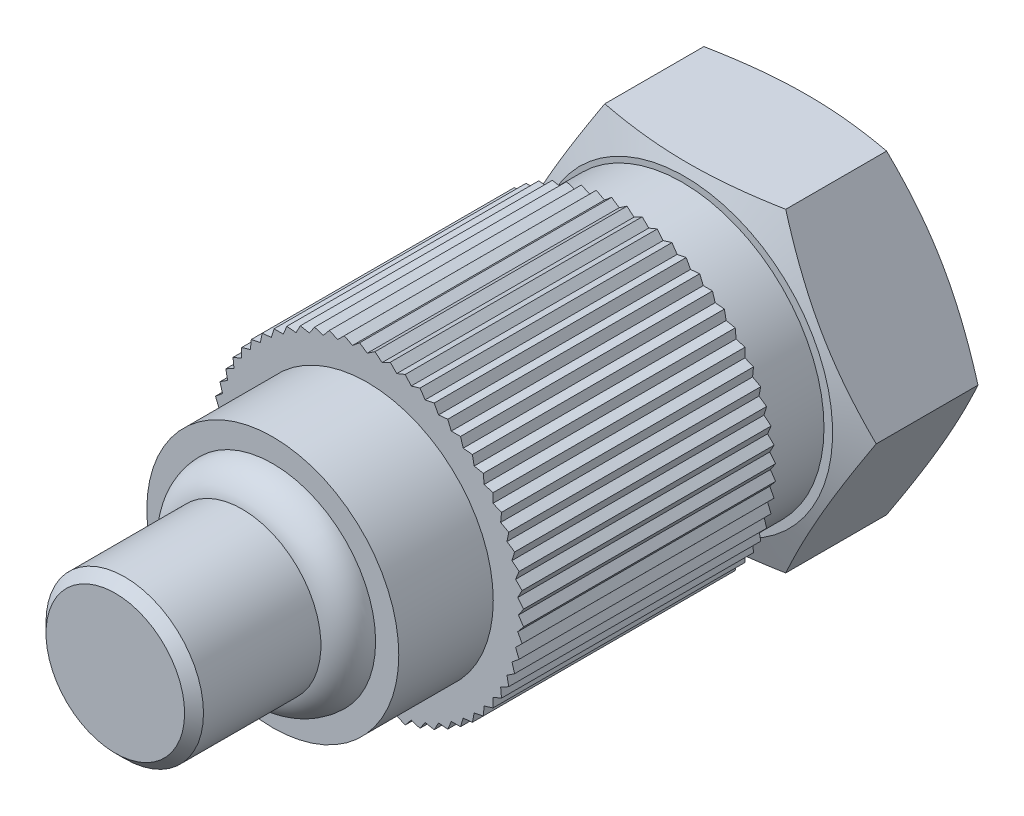
from build123d import *

# Parameters (mm, degrees)
BOSS_EXTRUDE1_DEPTH       = 4
SKETCH2_R                 = 4.5
BOSS_EXTRUDE2_DEPTH       = 2
SKETCH3_R                 = 5
BOSS_EXTRUDE3_DEPTH       = 8
SKETCH4_R                 = 4
BOSS_EXTRUDE4_DEPTH       = 3
SKETCH5_R                 = 1
SKETCH6_R                 = 2.5
BOSS_EXTRUDE5_DEPTH       = 5
SKETCH7_R                 = 0.075
CUT_EXTRUDE1_DEPTH        = 5
CHAMFER1_SIZE             = 0.3
CUT_EXTRUDE4_DEPTH        = 8
CIRPATTERN1_COUNT         = 64
CIRPATTERN1_COPY_1_DEPTH  = 8
CIRPATTERN1_COPY_2_DEPTH  = 8
CIRPATTERN1_COPY_3_DEPTH  = 8
CIRPATTERN1_COPY_4_DEPTH  = 8
CIRPATTERN1_COPY_5_DEPTH  = 8
CIRPATTERN1_COPY_6_DEPTH  = 8
CIRPATTERN1_COPY_7_DEPTH  = 8
CIRPATTERN1_COPY_8_DEPTH  = 8
CIRPATTERN1_COPY_9_DEPTH  = 8
CIRPATTERN1_COPY_10_DEPTH = 8
CIRPATTERN1_COPY_11_DEPTH = 8
CIRPATTERN1_COPY_12_DEPTH = 8
CIRPATTERN1_COPY_13_DEPTH = 8
CIRPATTERN1_COPY_14_DEPTH = 8
CIRPATTERN1_COPY_15_DEPTH = 8
CIRPATTERN1_COPY_16_DEPTH = 8
CIRPATTERN1_COPY_17_DEPTH = 8
CIRPATTERN1_COPY_18_DEPTH = 8
CIRPATTERN1_COPY_19_DEPTH = 8
CIRPATTERN1_COPY_20_DEPTH = 8
CIRPATTERN1_COPY_21_DEPTH = 8
CIRPATTERN1_COPY_22_DEPTH = 8
CIRPATTERN1_COPY_23_DEPTH = 8
CIRPATTERN1_COPY_24_DEPTH = 8
CIRPATTERN1_COPY_25_DEPTH = 8
CIRPATTERN1_COPY_26_DEPTH = 8
CIRPATTERN1_COPY_27_DEPTH = 8
CIRPATTERN1_COPY_28_DEPTH = 8
CIRPATTERN1_COPY_29_DEPTH = 8
CIRPATTERN1_COPY_30_DEPTH = 8
CIRPATTERN1_COPY_31_DEPTH = 8
CIRPATTERN1_COPY_32_DEPTH = 8
CIRPATTERN1_COPY_33_DEPTH = 8
CIRPATTERN1_COPY_34_DEPTH = 8
CIRPATTERN1_COPY_35_DEPTH = 8
CIRPATTERN1_COPY_36_DEPTH = 8
CIRPATTERN1_COPY_37_DEPTH = 8
CIRPATTERN1_COPY_38_DEPTH = 8
CIRPATTERN1_COPY_39_DEPTH = 8
CIRPATTERN1_COPY_40_DEPTH = 8
CIRPATTERN1_COPY_41_DEPTH = 8
CIRPATTERN1_COPY_42_DEPTH = 8
CIRPATTERN1_COPY_43_DEPTH = 8
CIRPATTERN1_COPY_44_DEPTH = 8
CIRPATTERN1_COPY_45_DEPTH = 8
CIRPATTERN1_COPY_46_DEPTH = 8
CIRPATTERN1_COPY_47_DEPTH = 8
CIRPATTERN1_COPY_48_DEPTH = 8
CIRPATTERN1_COPY_49_DEPTH = 8
CIRPATTERN1_COPY_50_DEPTH = 8
CIRPATTERN1_COPY_51_DEPTH = 8
CIRPATTERN1_COPY_52_DEPTH = 8
CIRPATTERN1_COPY_53_DEPTH = 8
CIRPATTERN1_COPY_54_DEPTH = 8
CIRPATTERN1_COPY_55_DEPTH = 8
CIRPATTERN1_COPY_56_DEPTH = 8
CIRPATTERN1_COPY_57_DEPTH = 8
CIRPATTERN1_COPY_58_DEPTH = 8
CIRPATTERN1_COPY_59_DEPTH = 8
CIRPATTERN1_COPY_60_DEPTH = 8
CIRPATTERN1_COPY_61_DEPTH = 8
CIRPATTERN1_COPY_62_DEPTH = 8
CIRPATTERN1_COPY_63_DEPTH = 8
CUT_EXTRUDE6_DEPTH        = 0.1


with BuildPart() as part:
    # Sketch1 → Boss-Extrude1 (new body)
    with BuildSketch(Plane.XY):
        Polygon((-5.773502692, 0), (-2.886751346, -5), (2.886751346, -5), (5.773502692, 0), (2.886751346, 5), (-2.886751346, 5), align=None)
    extrude(amount=BOSS_EXTRUDE1_DEPTH)

    # Sketch2 → Boss-Extrude2 (add)
    with BuildSketch(Plane.XY.offset(4)):
        Circle(SKETCH2_R)
    extrude(amount=BOSS_EXTRUDE2_DEPTH)

    # Sketch3 → Boss-Extrude3 (add)
    with BuildSketch(Plane.XY.offset(6)):
        Circle(SKETCH3_R)
    extrude(amount=BOSS_EXTRUDE3_DEPTH)

    # Sketch4 → Boss-Extrude4 (add)
    with BuildSketch(Plane.XY.offset(14)):
        Circle(SKETCH4_R)
    extrude(amount=BOSS_EXTRUDE4_DEPTH)

    # Sketch5 → Revolve1 (revolve)
    with BuildSketch(Plane(origin=(0, 0, 0), x_dir=(0, 0, -1), z_dir=(1, 0, 0)), mode=Mode.PRIVATE) as revolve1_sk:
        with Locations((-17, 2.264629469)):
            Circle(SKETCH5_R)
    revolve(revolve1_sk.sketch.rotate(Axis((0, 0, 17), (0, 0, 1)), 90), axis=Axis((0, 0, 17), (0, 0, 1)))

    # Sketch6 → Boss-Extrude5 (add)
    with BuildSketch(Plane.XY.offset(17)):
        with Locations(Location((0, 0, 0), (0, 0, 180))):
            Circle(SKETCH6_R)
    extrude(amount=BOSS_EXTRUDE5_DEPTH)

    # Sketch7 → Cut-Extrude1 (cut)
    with BuildSketch(Plane(origin=(0, 0, 0), x_dir=(-1, 0, 0), z_dir=(0, 0, -1))):
        Circle(SKETCH7_R)
    extrude(amount=-CUT_EXTRUDE1_DEPTH, mode=Mode.SUBTRACT)

    # Sketch8 → Cut-Revolve1 (revolve, cut)
    with BuildSketch(Plane(origin=(0, 0, 0), x_dir=(1, 0, 0), z_dir=(0, 1, 0)), mode=Mode.PRIVATE) as cut_revolve1_sk:
        Polygon((4.773502692, 0), (6.075, -0.5), (6.075, 0), align=None)
    cut_revolve1 = revolve(cut_revolve1_sk.sketch.rotate(Axis((0.075, 0, 0), (0, 0, 1)), 180), axis=Axis((0.075, 0, 0), (0, 0, 1)), mode=Mode.SUBTRACT)

    # Chamfer1
    chamfer1_edges = [part.edges().sort_by_distance(p)[0] for p in [
        (2.5, 0, 22),
    ]]
    chamfer(chamfer1_edges, length=CHAMFER1_SIZE)

    # Mirror1: Cut-Revolve1 across plane
    add(cut_revolve1.mirror(Plane(origin=(0, 0, 2), x_dir=(1, 0, 0), z_dir=(0, 0, -1))), mode=Mode.SUBTRACT)

    # Sketch11 → Cut-Extrude4 (cut)
    with BuildSketch(Plane.XY.offset(14)):
        Polygon((0, 5), (0, 4.8), (0.3, 5), align=None)
    cut_extrude4 = extrude(amount=-CUT_EXTRUDE4_DEPTH, mode=Mode.SUBTRACT)

    # Mirror2: Cut-Extrude4 across plane
    add(cut_extrude4.mirror(Plane(origin=(0, 0, 0), x_dir=(0, 0, 1), z_dir=(1, 0, 0))), mode=Mode.SUBTRACT)

    # CirPattern1: Cut-Extrude4 ×64 about axis
    cirpattern1_axis = Axis((0, 0, 0), (0, 0, 1))
    for i in range(1, CIRPATTERN1_COUNT):
        add(cut_extrude4.rotate(cirpattern1_axis, i * 360 / CIRPATTERN1_COUNT), mode=Mode.SUBTRACT)

    # CirPattern1 copy 1 sketch → CirPattern1 copy 1 (cut)
    with BuildSketch(Plane(origin=(0, 0, 14), x_dir=(-0.9951847266721969, -0.0980171403295606, 0), z_dir=(0, 0, 1))):
        Polygon((0, -5), (0, -4.8), (0.3, -5), align=None)
    extrude(amount=-CIRPATTERN1_COPY_1_DEPTH, mode=Mode.SUBTRACT)

    # CirPattern1 copy 2 sketch → CirPattern1 copy 2 (cut)
    with BuildSketch(Plane(origin=(0, 0, 14), x_dir=(-0.9807852804032304, -0.19509032201612825, 0), z_dir=(0, 0, 1))):
        Polygon((0, -5), (0, -4.8), (0.3, -5), align=None)
    extrude(amount=-CIRPATTERN1_COPY_2_DEPTH, mode=Mode.SUBTRACT)

    # CirPattern1 copy 3 sketch → CirPattern1 copy 3 (cut)
    with BuildSketch(Plane(origin=(0, 0, 14), x_dir=(-0.9569403357322088, -0.29028467725446233, 0), z_dir=(0, 0, 1))):
        Polygon((0, -5), (0, -4.8), (0.3, -5), align=None)
    extrude(amount=-CIRPATTERN1_COPY_3_DEPTH, mode=Mode.SUBTRACT)

    # CirPattern1 copy 4 sketch → CirPattern1 copy 4 (cut)
    with BuildSketch(Plane(origin=(0, 0, 14), x_dir=(-0.9238795325112867, -0.3826834323650898, 0), z_dir=(0, 0, 1))):
        Polygon((0, -5), (0, -4.8), (0.3, -5), align=None)
    extrude(amount=-CIRPATTERN1_COPY_4_DEPTH, mode=Mode.SUBTRACT)

    # CirPattern1 copy 5 sketch → CirPattern1 copy 5 (cut)
    with BuildSketch(Plane(origin=(0, 0, 14), x_dir=(-0.881921264348355, -0.47139673682599764, 0), z_dir=(0, 0, 1))):
        Polygon((0, -5), (0, -4.8), (0.3, -5), align=None)
    extrude(amount=-CIRPATTERN1_COPY_5_DEPTH, mode=Mode.SUBTRACT)

    # CirPattern1 copy 6 sketch → CirPattern1 copy 6 (cut)
    with BuildSketch(Plane(origin=(0, 0, 14), x_dir=(-0.8314696123025452, -0.5555702330196022, 0), z_dir=(0, 0, 1))):
        Polygon((0, -5), (0, -4.8), (0.3, -5), align=None)
    extrude(amount=-CIRPATTERN1_COPY_6_DEPTH, mode=Mode.SUBTRACT)

    # CirPattern1 copy 7 sketch → CirPattern1 copy 7 (cut)
    with BuildSketch(Plane(origin=(0, 0, 14), x_dir=(-0.773010453362737, -0.6343932841636455, 0), z_dir=(0, 0, 1))):
        Polygon((0, -5), (0, -4.8), (0.3, -5), align=None)
    extrude(amount=-CIRPATTERN1_COPY_7_DEPTH, mode=Mode.SUBTRACT)

    # CirPattern1 copy 8 sketch → CirPattern1 copy 8 (cut)
    with BuildSketch(Plane(origin=(0, 0, 14), x_dir=(-0.7071067811865476, -0.7071067811865475, 0), z_dir=(0, 0, 1))):
        Polygon((0, -5), (0, -4.8), (0.3, -5), align=None)
    extrude(amount=-CIRPATTERN1_COPY_8_DEPTH, mode=Mode.SUBTRACT)

    # CirPattern1 copy 9 sketch → CirPattern1 copy 9 (cut)
    with BuildSketch(Plane(origin=(0, 0, 14), x_dir=(-0.6343932841636455, -0.773010453362737, 0), z_dir=(0, 0, 1))):
        Polygon((0, -5), (0, -4.8), (0.3, -5), align=None)
    extrude(amount=-CIRPATTERN1_COPY_9_DEPTH, mode=Mode.SUBTRACT)

    # CirPattern1 copy 10 sketch → CirPattern1 copy 10 (cut)
    with BuildSketch(Plane(origin=(0, 0, 14), x_dir=(-0.5555702330196023, -0.8314696123025452, 0), z_dir=(0, 0, 1))):
        Polygon((0, -5), (0, -4.8), (0.3, -5), align=None)
    extrude(amount=-CIRPATTERN1_COPY_10_DEPTH, mode=Mode.SUBTRACT)

    # CirPattern1 copy 11 sketch → CirPattern1 copy 11 (cut)
    with BuildSketch(Plane(origin=(0, 0, 14), x_dir=(-0.4713967368259976, -0.881921264348355, 0), z_dir=(0, 0, 1))):
        Polygon((0, -5), (0, -4.8), (0.3, -5), align=None)
    extrude(amount=-CIRPATTERN1_COPY_11_DEPTH, mode=Mode.SUBTRACT)

    # CirPattern1 copy 12 sketch → CirPattern1 copy 12 (cut)
    with BuildSketch(Plane(origin=(0, 0, 14), x_dir=(-0.38268343236508984, -0.9238795325112867, 0), z_dir=(0, 0, 1))):
        Polygon((0, -5), (0, -4.8), (0.3, -5), align=None)
    extrude(amount=-CIRPATTERN1_COPY_12_DEPTH, mode=Mode.SUBTRACT)

    # CirPattern1 copy 13 sketch → CirPattern1 copy 13 (cut)
    with BuildSketch(Plane(origin=(0, 0, 14), x_dir=(-0.29028467725446233, -0.9569403357322089, 0), z_dir=(0, 0, 1))):
        Polygon((0, -5), (0, -4.8), (0.3, -5), align=None)
    extrude(amount=-CIRPATTERN1_COPY_13_DEPTH, mode=Mode.SUBTRACT)

    # CirPattern1 copy 14 sketch → CirPattern1 copy 14 (cut)
    with BuildSketch(Plane(origin=(0, 0, 14), x_dir=(-0.19509032201612833, -0.9807852804032304, 0), z_dir=(0, 0, 1))):
        Polygon((0, -5), (0, -4.8), (0.3, -5), align=None)
    extrude(amount=-CIRPATTERN1_COPY_14_DEPTH, mode=Mode.SUBTRACT)

    # CirPattern1 copy 15 sketch → CirPattern1 copy 15 (cut)
    with BuildSketch(Plane(origin=(0, 0, 14), x_dir=(-0.09801714032956055, -0.9951847266721969, 0), z_dir=(0, 0, 1))):
        Polygon((0, -5), (0, -4.8), (0.3, -5), align=None)
    extrude(amount=-CIRPATTERN1_COPY_15_DEPTH, mode=Mode.SUBTRACT)

    # CirPattern1 copy 16 sketch → CirPattern1 copy 16 (cut)
    with BuildSketch(Plane(origin=(0, 0, 14), x_dir=(0, -1, 0), z_dir=(0, 0, 1))):
        Polygon((0, -5), (0, -4.8), (0.3, -5), align=None)
    extrude(amount=-CIRPATTERN1_COPY_16_DEPTH, mode=Mode.SUBTRACT)

    # CirPattern1 copy 17 sketch → CirPattern1 copy 17 (cut)
    with BuildSketch(Plane(origin=(0, 0, 14), x_dir=(0.09801714032956065, -0.9951847266721969, 0), z_dir=(0, 0, 1))):
        Polygon((0, -5), (0, -4.8), (0.3, -5), align=None)
    extrude(amount=-CIRPATTERN1_COPY_17_DEPTH, mode=Mode.SUBTRACT)

    # CirPattern1 copy 18 sketch → CirPattern1 copy 18 (cut)
    with BuildSketch(Plane(origin=(0, 0, 14), x_dir=(0.1950903220161282, -0.9807852804032304, 0), z_dir=(0, 0, 1))):
        Polygon((0, -5), (0, -4.8), (0.3, -5), align=None)
    extrude(amount=-CIRPATTERN1_COPY_18_DEPTH, mode=Mode.SUBTRACT)

    # CirPattern1 copy 19 sketch → CirPattern1 copy 19 (cut)
    with BuildSketch(Plane(origin=(0, 0, 14), x_dir=(0.2902846772544624, -0.9569403357322088, 0), z_dir=(0, 0, 1))):
        Polygon((0, -5), (0, -4.8), (0.3, -5), align=None)
    extrude(amount=-CIRPATTERN1_COPY_19_DEPTH, mode=Mode.SUBTRACT)

    # CirPattern1 copy 20 sketch → CirPattern1 copy 20 (cut)
    with BuildSketch(Plane(origin=(0, 0, 14), x_dir=(0.3826834323650897, -0.9238795325112867, 0), z_dir=(0, 0, 1))):
        Polygon((0, -5), (0, -4.8), (0.3, -5), align=None)
    extrude(amount=-CIRPATTERN1_COPY_20_DEPTH, mode=Mode.SUBTRACT)

    # CirPattern1 copy 21 sketch → CirPattern1 copy 21 (cut)
    with BuildSketch(Plane(origin=(0, 0, 14), x_dir=(0.4713967368259977, -0.881921264348355, 0), z_dir=(0, 0, 1))):
        Polygon((0, -5), (0, -4.8), (0.3, -5), align=None)
    extrude(amount=-CIRPATTERN1_COPY_21_DEPTH, mode=Mode.SUBTRACT)

    # CirPattern1 copy 22 sketch → CirPattern1 copy 22 (cut)
    with BuildSketch(Plane(origin=(0, 0, 14), x_dir=(0.5555702330196023, -0.8314696123025451, 0), z_dir=(0, 0, 1))):
        Polygon((0, -5), (0, -4.8), (0.3, -5), align=None)
    extrude(amount=-CIRPATTERN1_COPY_22_DEPTH, mode=Mode.SUBTRACT)

    # CirPattern1 copy 23 sketch → CirPattern1 copy 23 (cut)
    with BuildSketch(Plane(origin=(0, 0, 14), x_dir=(0.6343932841636454, -0.7730104533627371, 0), z_dir=(0, 0, 1))):
        Polygon((0, -5), (0, -4.8), (0.3, -5), align=None)
    extrude(amount=-CIRPATTERN1_COPY_23_DEPTH, mode=Mode.SUBTRACT)

    # CirPattern1 copy 24 sketch → CirPattern1 copy 24 (cut)
    with BuildSketch(Plane(origin=(0, 0, 14), x_dir=(0.7071067811865475, -0.7071067811865476, 0), z_dir=(0, 0, 1))):
        Polygon((0, -5), (0, -4.8), (0.3, -5), align=None)
    extrude(amount=-CIRPATTERN1_COPY_24_DEPTH, mode=Mode.SUBTRACT)

    # CirPattern1 copy 25 sketch → CirPattern1 copy 25 (cut)
    with BuildSketch(Plane(origin=(0, 0, 14), x_dir=(0.773010453362737, -0.6343932841636455, 0), z_dir=(0, 0, 1))):
        Polygon((0, -5), (0, -4.8), (0.3, -5), align=None)
    extrude(amount=-CIRPATTERN1_COPY_25_DEPTH, mode=Mode.SUBTRACT)

    # CirPattern1 copy 26 sketch → CirPattern1 copy 26 (cut)
    with BuildSketch(Plane(origin=(0, 0, 14), x_dir=(0.8314696123025453, -0.5555702330196022, 0), z_dir=(0, 0, 1))):
        Polygon((0, -5), (0, -4.8), (0.3, -5), align=None)
    extrude(amount=-CIRPATTERN1_COPY_26_DEPTH, mode=Mode.SUBTRACT)

    # CirPattern1 copy 27 sketch → CirPattern1 copy 27 (cut)
    with BuildSketch(Plane(origin=(0, 0, 14), x_dir=(0.8819212643483549, -0.47139673682599786, 0), z_dir=(0, 0, 1))):
        Polygon((0, -5), (0, -4.8), (0.3, -5), align=None)
    extrude(amount=-CIRPATTERN1_COPY_27_DEPTH, mode=Mode.SUBTRACT)

    # CirPattern1 copy 28 sketch → CirPattern1 copy 28 (cut)
    with BuildSketch(Plane(origin=(0, 0, 14), x_dir=(0.9238795325112867, -0.3826834323650899, 0), z_dir=(0, 0, 1))):
        Polygon((0, -5), (0, -4.8), (0.3, -5), align=None)
    extrude(amount=-CIRPATTERN1_COPY_28_DEPTH, mode=Mode.SUBTRACT)

    # CirPattern1 copy 29 sketch → CirPattern1 copy 29 (cut)
    with BuildSketch(Plane(origin=(0, 0, 14), x_dir=(0.9569403357322088, -0.2902846772544624, 0), z_dir=(0, 0, 1))):
        Polygon((0, -5), (0, -4.8), (0.3, -5), align=None)
    extrude(amount=-CIRPATTERN1_COPY_29_DEPTH, mode=Mode.SUBTRACT)

    # CirPattern1 copy 30 sketch → CirPattern1 copy 30 (cut)
    with BuildSketch(Plane(origin=(0, 0, 14), x_dir=(0.9807852804032304, -0.19509032201612816, 0), z_dir=(0, 0, 1))):
        Polygon((0, -5), (0, -4.8), (0.3, -5), align=None)
    extrude(amount=-CIRPATTERN1_COPY_30_DEPTH, mode=Mode.SUBTRACT)

    # CirPattern1 copy 31 sketch → CirPattern1 copy 31 (cut)
    with BuildSketch(Plane(origin=(0, 0, 14), x_dir=(0.9951847266721968, -0.09801714032956083, 0), z_dir=(0, 0, 1))):
        Polygon((0, -5), (0, -4.8), (0.3, -5), align=None)
    extrude(amount=-CIRPATTERN1_COPY_31_DEPTH, mode=Mode.SUBTRACT)

    # CirPattern1 copy 32 sketch → CirPattern1 copy 32 (cut)
    with BuildSketch(Plane.XY.offset(14)):
        Polygon((0, -5), (0, -4.8), (0.3, -5), align=None)
    extrude(amount=-CIRPATTERN1_COPY_32_DEPTH, mode=Mode.SUBTRACT)

    # CirPattern1 copy 33 sketch → CirPattern1 copy 33 (cut)
    with BuildSketch(Plane(origin=(0, 0, 14), x_dir=(0.9951847266721969, 0.09801714032956059, 0), z_dir=(0, 0, 1))):
        Polygon((0, -5), (0, -4.8), (0.3, -5), align=None)
    extrude(amount=-CIRPATTERN1_COPY_33_DEPTH, mode=Mode.SUBTRACT)

    # CirPattern1 copy 34 sketch → CirPattern1 copy 34 (cut)
    with BuildSketch(Plane(origin=(0, 0, 14), x_dir=(0.9807852804032304, 0.19509032201612836, 0), z_dir=(0, 0, 1))):
        Polygon((0, -5), (0, -4.8), (0.3, -5), align=None)
    extrude(amount=-CIRPATTERN1_COPY_34_DEPTH, mode=Mode.SUBTRACT)

    # CirPattern1 copy 35 sketch → CirPattern1 copy 35 (cut)
    with BuildSketch(Plane(origin=(0, 0, 14), x_dir=(0.9569403357322089, 0.2902846772544621, 0), z_dir=(0, 0, 1))):
        Polygon((0, -5), (0, -4.8), (0.3, -5), align=None)
    extrude(amount=-CIRPATTERN1_COPY_35_DEPTH, mode=Mode.SUBTRACT)

    # CirPattern1 copy 36 sketch → CirPattern1 copy 36 (cut)
    with BuildSketch(Plane(origin=(0, 0, 14), x_dir=(0.9238795325112868, 0.38268343236508967, 0), z_dir=(0, 0, 1))):
        Polygon((0, -5), (0, -4.8), (0.3, -5), align=None)
    extrude(amount=-CIRPATTERN1_COPY_36_DEPTH, mode=Mode.SUBTRACT)

    # CirPattern1 copy 37 sketch → CirPattern1 copy 37 (cut)
    with BuildSketch(Plane(origin=(0, 0, 14), x_dir=(0.881921264348355, 0.47139673682599764, 0), z_dir=(0, 0, 1))):
        Polygon((0, -5), (0, -4.8), (0.3, -5), align=None)
    extrude(amount=-CIRPATTERN1_COPY_37_DEPTH, mode=Mode.SUBTRACT)

    # CirPattern1 copy 38 sketch → CirPattern1 copy 38 (cut)
    with BuildSketch(Plane(origin=(0, 0, 14), x_dir=(0.8314696123025452, 0.5555702330196023, 0), z_dir=(0, 0, 1))):
        Polygon((0, -5), (0, -4.8), (0.3, -5), align=None)
    extrude(amount=-CIRPATTERN1_COPY_38_DEPTH, mode=Mode.SUBTRACT)

    # CirPattern1 copy 39 sketch → CirPattern1 copy 39 (cut)
    with BuildSketch(Plane(origin=(0, 0, 14), x_dir=(0.7730104533627371, 0.6343932841636453, 0), z_dir=(0, 0, 1))):
        Polygon((0, -5), (0, -4.8), (0.3, -5), align=None)
    extrude(amount=-CIRPATTERN1_COPY_39_DEPTH, mode=Mode.SUBTRACT)

    # CirPattern1 copy 40 sketch → CirPattern1 copy 40 (cut)
    with BuildSketch(Plane(origin=(0, 0, 14), x_dir=(0.7071067811865477, 0.7071067811865475, 0), z_dir=(0, 0, 1))):
        Polygon((0, -5), (0, -4.8), (0.3, -5), align=None)
    extrude(amount=-CIRPATTERN1_COPY_40_DEPTH, mode=Mode.SUBTRACT)

    # CirPattern1 copy 41 sketch → CirPattern1 copy 41 (cut)
    with BuildSketch(Plane(origin=(0, 0, 14), x_dir=(0.6343932841636459, 0.7730104533627367, 0), z_dir=(0, 0, 1))):
        Polygon((0, -5), (0, -4.8), (0.3, -5), align=None)
    extrude(amount=-CIRPATTERN1_COPY_41_DEPTH, mode=Mode.SUBTRACT)

    # CirPattern1 copy 42 sketch → CirPattern1 copy 42 (cut)
    with BuildSketch(Plane(origin=(0, 0, 14), x_dir=(0.5555702330196022, 0.8314696123025452, 0), z_dir=(0, 0, 1))):
        Polygon((0, -5), (0, -4.8), (0.3, -5), align=None)
    extrude(amount=-CIRPATTERN1_COPY_42_DEPTH, mode=Mode.SUBTRACT)

    # CirPattern1 copy 43 sketch → CirPattern1 copy 43 (cut)
    with BuildSketch(Plane(origin=(0, 0, 14), x_dir=(0.47139673682599786, 0.8819212643483549, 0), z_dir=(0, 0, 1))):
        Polygon((0, -5), (0, -4.8), (0.3, -5), align=None)
    extrude(amount=-CIRPATTERN1_COPY_43_DEPTH, mode=Mode.SUBTRACT)

    # CirPattern1 copy 44 sketch → CirPattern1 copy 44 (cut)
    with BuildSketch(Plane(origin=(0, 0, 14), x_dir=(0.3826834323650895, 0.9238795325112868, 0), z_dir=(0, 0, 1))):
        Polygon((0, -5), (0, -4.8), (0.3, -5), align=None)
    extrude(amount=-CIRPATTERN1_COPY_44_DEPTH, mode=Mode.SUBTRACT)

    # CirPattern1 copy 45 sketch → CirPattern1 copy 45 (cut)
    with BuildSketch(Plane(origin=(0, 0, 14), x_dir=(0.29028467725446244, 0.9569403357322088, 0), z_dir=(0, 0, 1))):
        Polygon((0, -5), (0, -4.8), (0.3, -5), align=None)
    extrude(amount=-CIRPATTERN1_COPY_45_DEPTH, mode=Mode.SUBTRACT)

    # CirPattern1 copy 46 sketch → CirPattern1 copy 46 (cut)
    with BuildSketch(Plane(origin=(0, 0, 14), x_dir=(0.19509032201612866, 0.9807852804032303, 0), z_dir=(0, 0, 1))):
        Polygon((0, -5), (0, -4.8), (0.3, -5), align=None)
    extrude(amount=-CIRPATTERN1_COPY_46_DEPTH, mode=Mode.SUBTRACT)

    # CirPattern1 copy 47 sketch → CirPattern1 copy 47 (cut)
    with BuildSketch(Plane(origin=(0, 0, 14), x_dir=(0.09801714032956045, 0.9951847266721969, 0), z_dir=(0, 0, 1))):
        Polygon((0, -5), (0, -4.8), (0.3, -5), align=None)
    extrude(amount=-CIRPATTERN1_COPY_47_DEPTH, mode=Mode.SUBTRACT)

    # CirPattern1 copy 48 sketch → CirPattern1 copy 48 (cut)
    with BuildSketch(Plane(origin=(0, 0, 14), x_dir=(0, 1, 0), z_dir=(0, 0, 1))):
        Polygon((0, -5), (0, -4.8), (0.3, -5), align=None)
    extrude(amount=-CIRPATTERN1_COPY_48_DEPTH, mode=Mode.SUBTRACT)

    # CirPattern1 copy 49 sketch → CirPattern1 copy 49 (cut)
    with BuildSketch(Plane(origin=(0, 0, 14), x_dir=(-0.09801714032956009, 0.9951847266721969, 0), z_dir=(0, 0, 1))):
        Polygon((0, -5), (0, -4.8), (0.3, -5), align=None)
    extrude(amount=-CIRPATTERN1_COPY_49_DEPTH, mode=Mode.SUBTRACT)

    # CirPattern1 copy 50 sketch → CirPattern1 copy 50 (cut)
    with BuildSketch(Plane(origin=(0, 0, 14), x_dir=(-0.1950903220161283, 0.9807852804032304, 0), z_dir=(0, 0, 1))):
        Polygon((0, -5), (0, -4.8), (0.3, -5), align=None)
    extrude(amount=-CIRPATTERN1_COPY_50_DEPTH, mode=Mode.SUBTRACT)

    # CirPattern1 copy 51 sketch → CirPattern1 copy 51 (cut)
    with BuildSketch(Plane(origin=(0, 0, 14), x_dir=(-0.29028467725446205, 0.9569403357322089, 0), z_dir=(0, 0, 1))):
        Polygon((0, -5), (0, -4.8), (0.3, -5), align=None)
    extrude(amount=-CIRPATTERN1_COPY_51_DEPTH, mode=Mode.SUBTRACT)

    # CirPattern1 copy 52 sketch → CirPattern1 copy 52 (cut)
    with BuildSketch(Plane(origin=(0, 0, 14), x_dir=(-0.38268343236509, 0.9238795325112866, 0), z_dir=(0, 0, 1))):
        Polygon((0, -5), (0, -4.8), (0.3, -5), align=None)
    extrude(amount=-CIRPATTERN1_COPY_52_DEPTH, mode=Mode.SUBTRACT)

    # CirPattern1 copy 53 sketch → CirPattern1 copy 53 (cut)
    with BuildSketch(Plane(origin=(0, 0, 14), x_dir=(-0.4713967368259976, 0.881921264348355, 0), z_dir=(0, 0, 1))):
        Polygon((0, -5), (0, -4.8), (0.3, -5), align=None)
    extrude(amount=-CIRPATTERN1_COPY_53_DEPTH, mode=Mode.SUBTRACT)

    # CirPattern1 copy 54 sketch → CirPattern1 copy 54 (cut)
    with BuildSketch(Plane(origin=(0, 0, 14), x_dir=(-0.5555702330196018, 0.8314696123025455, 0), z_dir=(0, 0, 1))):
        Polygon((0, -5), (0, -4.8), (0.3, -5), align=None)
    extrude(amount=-CIRPATTERN1_COPY_54_DEPTH, mode=Mode.SUBTRACT)

    # CirPattern1 copy 55 sketch → CirPattern1 copy 55 (cut)
    with BuildSketch(Plane(origin=(0, 0, 14), x_dir=(-0.6343932841636456, 0.7730104533627369, 0), z_dir=(0, 0, 1))):
        Polygon((0, -5), (0, -4.8), (0.3, -5), align=None)
    extrude(amount=-CIRPATTERN1_COPY_55_DEPTH, mode=Mode.SUBTRACT)

    # CirPattern1 copy 56 sketch → CirPattern1 copy 56 (cut)
    with BuildSketch(Plane(origin=(0, 0, 14), x_dir=(-0.7071067811865474, 0.7071067811865477, 0), z_dir=(0, 0, 1))):
        Polygon((0, -5), (0, -4.8), (0.3, -5), align=None)
    extrude(amount=-CIRPATTERN1_COPY_56_DEPTH, mode=Mode.SUBTRACT)

    # CirPattern1 copy 57 sketch → CirPattern1 copy 57 (cut)
    with BuildSketch(Plane(origin=(0, 0, 14), x_dir=(-0.7730104533627372, 0.6343932841636453, 0), z_dir=(0, 0, 1))):
        Polygon((0, -5), (0, -4.8), (0.3, -5), align=None)
    extrude(amount=-CIRPATTERN1_COPY_57_DEPTH, mode=Mode.SUBTRACT)

    # CirPattern1 copy 58 sketch → CirPattern1 copy 58 (cut)
    with BuildSketch(Plane(origin=(0, 0, 14), x_dir=(-0.8314696123025452, 0.5555702330196022, 0), z_dir=(0, 0, 1))):
        Polygon((0, -5), (0, -4.8), (0.3, -5), align=None)
    extrude(amount=-CIRPATTERN1_COPY_58_DEPTH, mode=Mode.SUBTRACT)

    # CirPattern1 copy 59 sketch → CirPattern1 copy 59 (cut)
    with BuildSketch(Plane(origin=(0, 0, 14), x_dir=(-0.8819212643483548, 0.4713967368259979, 0), z_dir=(0, 0, 1))):
        Polygon((0, -5), (0, -4.8), (0.3, -5), align=None)
    extrude(amount=-CIRPATTERN1_COPY_59_DEPTH, mode=Mode.SUBTRACT)

    # CirPattern1 copy 60 sketch → CirPattern1 copy 60 (cut)
    with BuildSketch(Plane(origin=(0, 0, 14), x_dir=(-0.9238795325112868, 0.38268343236508956, 0), z_dir=(0, 0, 1))):
        Polygon((0, -5), (0, -4.8), (0.3, -5), align=None)
    extrude(amount=-CIRPATTERN1_COPY_60_DEPTH, mode=Mode.SUBTRACT)

    # CirPattern1 copy 61 sketch → CirPattern1 copy 61 (cut)
    with BuildSketch(Plane(origin=(0, 0, 14), x_dir=(-0.9569403357322088, 0.2902846772544625, 0), z_dir=(0, 0, 1))):
        Polygon((0, -5), (0, -4.8), (0.3, -5), align=None)
    extrude(amount=-CIRPATTERN1_COPY_61_DEPTH, mode=Mode.SUBTRACT)

    # CirPattern1 copy 62 sketch → CirPattern1 copy 62 (cut)
    with BuildSketch(Plane(origin=(0, 0, 14), x_dir=(-0.9807852804032303, 0.19509032201612872, 0), z_dir=(0, 0, 1))):
        Polygon((0, -5), (0, -4.8), (0.3, -5), align=None)
    extrude(amount=-CIRPATTERN1_COPY_62_DEPTH, mode=Mode.SUBTRACT)

    # CirPattern1 copy 63 sketch → CirPattern1 copy 63 (cut)
    with BuildSketch(Plane(origin=(0, 0, 14), x_dir=(-0.9951847266721969, 0.0980171403295605, 0), z_dir=(0, 0, 1))):
        Polygon((0, -5), (0, -4.8), (0.3, -5), align=None)
    extrude(amount=-CIRPATTERN1_COPY_63_DEPTH, mode=Mode.SUBTRACT)

    # Sketch12 → Cut-Extrude6 (cut)
    # profile 1 of 10: a face of its own
    with BuildSketch(Plane.XY):
        with BuildLine():
            Line((3.569861646, 1.324172336), (3.298815989, 1.260935296))
            Line((3.298815989, 1.260935296), (3.321410265, 1.164019152))
            add(Edge.make_bspline(
                [(3.321410265, 1.164019152), (3.335814209, 1.163250572), (3.363532373, 1.161771559), (3.402869991, 1.155855215), (3.438436755, 1.14794527), (3.47007551, 1.137137686), (3.49803723, 1.123416236), (3.523148079, 1.108182005), (3.544328737, 1.089631224), (3.562954561, 1.069270146), (3.578138613, 1.04554449), (3.591716302, 1.01942116), (3.602640452, 0.989951238), (3.607941129, 0.969093321), (3.610684374, 0.958298783)],
                knots=[0, 0, 0, 0, 1.334160493, 2.567385653, 3.676319222, 4.702522594, 5.652266118, 6.554829424, 7.411110638, 8.248867937, 9.099862347, 10.009176407, 10.969694751, 12, 12, 12, 12], degree=3))
            add(Edge.make_bspline(
                [(3.610684374, 0.958298783), (3.612513296, 0.949940883), (3.616116834, 0.933473262), (3.618387721, 0.908379666), (3.618638732, 0.883600602), (3.616359896, 0.858987298), (3.612474995, 0.834571634), (3.605562434, 0.810400553), (3.596803143, 0.786366445), (3.585459075, 0.762700121), (3.572179132, 0.739358504), (3.556623271, 0.716387645), (3.538124315, 0.694401513), (3.51790548, 0.672433723), (3.495048902, 0.651351754), (3.469686259, 0.631213556), (3.44242536, 0.611006127), (3.412541857, 0.591825278), (3.380366221, 0.573519475), (3.346338044, 0.555605757), (3.309982169, 0.5392322), (3.271565622, 0.523676737), (3.231116724, 0.509064937), (3.188616231, 0.49546892), (3.144076033, 0.48284291), (3.113559221, 0.475358788), (3.09795916, 0.471532937)],
                knots=[0, 0, 0, 0, 0.783481401, 1.543698078, 2.304458815, 3.051776038, 3.806859377, 4.56685832, 5.352027806, 6.149069513, 6.969037622, 7.811946676, 8.687551184, 9.59999441, 10.547146996, 11.533838168, 12.567228232, 13.656179317, 14.785969673, 15.959588794, 17.179398817, 18.438729221, 19.757754987, 21.120231282, 22.527874842, 24, 24, 24, 24], degree=3))
            add(Edge.make_bspline(
                [(3.09795916, 0.471532937), (3.067062098, 0.464695146), (3.007564258, 0.451527751), (2.920281324, 0.43920002), (2.839064903, 0.43192246), (2.775096554, 0.431670847), (2.727234994, 0.434244697), (2.693952857, 0.438442235), (2.6623962, 0.443310888), (2.632694635, 0.45033799), (2.604747298, 0.458837927), (2.578652046, 0.469240194), (2.553998759, 0.480398863), (2.531709176, 0.494005128), (2.511095577, 0.508768078), (2.492484417, 0.52521967), (2.47572993, 0.543259535), (2.460933145, 0.562849387), (2.448008807, 0.5839246), (2.437079548, 0.606542356), (2.427890071, 0.630718558), (2.423470883, 0.647638738), (2.421221672, 0.656250514)],
                knots=[0, 0, 0, 0, 2.429077285, 4.67762455, 6.763647163, 8.685928547, 9.583963147, 10.442145845, 11.260771583, 12.034570999, 12.783811174, 13.501535151, 14.190690493, 14.858791403, 15.503037259, 16.135638062, 16.762705806, 17.39051411, 18.017720776, 18.657942175, 19.316939752, 20, 20, 20, 20], degree=3))
            add(Edge.make_bspline(
                [(2.421221672, 0.656250514), (2.418561645, 0.669083648), (2.413472339, 0.693636682), (2.409430737, 0.72941291), (2.409189607, 0.762262401), (2.41298482, 0.792427637), (2.4207558, 0.82038871), (2.432024072, 0.846945129), (2.447176179, 0.872308583), (2.466783865, 0.896711828), (2.491528259, 0.920646299), (2.521599605, 0.945303621), (2.557783162, 0.970481764), (2.584171935, 0.98697257), (2.598133319, 0.995697284)],
                knots=[0, 0, 0, 0, 1.121947801, 2.146570316, 3.077822577, 3.9288204, 4.741254363, 5.555287258, 6.392290901, 7.263133254, 8.228063389, 9.335266199, 10.590181761, 12, 12, 12, 12], degree=3))
            Line((2.598133319, 0.995697284), (2.575539044, 1.092613428))
            Line((2.575539044, 1.092613428), (2.295840149, 1.027370931))
            add(Edge.make_bspline(
                [(2.295840149, 1.027370931), (2.29547565, 0.994652785), (2.294743313, 0.928916836), (2.300525081, 0.846229288), (2.309335216, 0.779012222), (2.31717801, 0.726236961), (2.327747394, 0.671578194), (2.336059122, 0.634578355), (2.340301069, 0.615695232)],
                knots=[0, 0, 0, 0, 1.417916498, 2.848819237, 3.587619847, 4.356277974, 5.161115091, 6, 6, 6, 6], degree=3))
            add(Edge.make_bspline(
                [(2.340301069, 0.615695232), (2.345421538, 0.595693771), (2.355392373, 0.556745916), (2.376654304, 0.501834883), (2.402178443, 0.451992882), (2.431901628, 0.407034961), (2.466278605, 0.36716936), (2.505168771, 0.332415898), (2.548396598, 0.302602379), (2.596005831, 0.277898361), (2.648039753, 0.258630385), (2.704165023, 0.24416739), (2.764591229, 0.235697804), (2.829102549, 0.231507564), (2.897928824, 0.233217696), (2.970920701, 0.239998253), (3.048154745, 0.251620724), (3.100565191, 0.263021808), (3.127576755, 0.268897758)],
                knots=[0, 0, 0, 0, 1.010910588, 1.968496096, 2.877900192, 3.750072898, 4.602791937, 5.449820879, 6.298592896, 7.169164463, 8.070720785, 9.011715922, 10.003283366, 11.055839483, 12.176036846, 13.372543882, 14.645848167, 16, 16, 16, 16], degree=3))
            add(Edge.make_bspline(
                [(3.127576755, 0.268897758), (3.144743341, 0.273121459), (3.178453949, 0.281415684), (3.227654852, 0.296112533), (3.274870783, 0.312266882), (3.319841011, 0.330589239), (3.362829336, 0.350372975), (3.403646052, 0.371846009), (3.442522846, 0.394834535), (3.478979191, 0.419894779), (3.513225433, 0.446188086), (3.544799303, 0.474141021), (3.57393367, 0.50325195), (3.600126617, 0.53403996), (3.623499714, 0.566288391), (3.644550384, 0.599720145), (3.662550219, 0.634871367), (3.678048769, 0.671243247), (3.690513611, 0.708800528), (3.699974975, 0.747417885), (3.7064609, 0.78695568), (3.709860223, 0.827426295), (3.710239884, 0.868781596), (3.707296527, 0.910999253), (3.701414799, 0.95423647), (3.695269243, 0.983090576), (3.692138599, 0.99778932)],
                knots=[0, 0, 0, 0, 1.222001986, 2.399686771, 3.548618775, 4.670559162, 5.755184537, 6.818882557, 7.857681685, 8.875582536, 9.875377632, 10.840650643, 11.788824324, 12.720393509, 13.63180847, 14.540248537, 15.448766333, 16.358940781, 17.27105279, 18.181227239, 19.104879261, 20.038038952, 20.986237458, 21.961070984, 22.961336837, 24, 24, 24, 24], degree=3))
            add(Edge.make_bspline(
                [(3.692138599, 0.99778932), (3.685069357, 1.026247474), (3.671467484, 1.081003588), (3.649533627, 1.14741032), (3.629797414, 1.198823885), (3.612342872, 1.238746626), (3.592172184, 1.280842699), (3.577449556, 1.30943574), (3.569861646, 1.324172336)],
                knots=[0, 0, 0, 0, 1.50930089, 2.904034152, 3.59706268, 4.344228287, 5.146630182, 6, 6, 6, 6], degree=3))
        make_face()
    # profile 2 of 10: a face of its own
    with BuildSketch(Plane.XY):
        with BuildLine():
            Line((2.46424441, 2.932598797), (2.241621555, 2.726507928))
            Line((2.241621555, 2.726507928), (2.308479686, 2.654328795))
            add(Edge.make_bspline(
                [(2.308479686, 2.654328795), (2.323253033, 2.661109048), (2.351058056, 2.673870212), (2.391245407, 2.690031361), (2.427392254, 2.701516598), (2.459902217, 2.708395061), (2.489097069, 2.711176013), (2.516117884, 2.708732175), (2.541563015, 2.700678844), (2.56584662, 2.686129008), (2.590291966, 2.665774813), (2.605953778, 2.649489245), (2.614397722, 2.640709008)],
                knots=[0, 0, 0, 0, 1.440880422, 2.71189161, 3.8375922, 4.798380592, 5.653265308, 6.427715265, 7.187431668, 7.998069411, 8.920674656, 10, 10, 10, 10], degree=3))
            Line((2.614397722, 2.640709008), (2.829895461, 2.408126868))
            Line((2.829895461, 2.408126868), (2.444272245, 2.050604851))
            Line((2.444272245, 2.050604851), (2.29810506, 2.20813579))
            add(Edge.make_bspline(
                [(2.29810506, 2.20813579), (2.293534431, 2.213372979), (2.284884475, 2.223284407), (2.274000722, 2.238474389), (2.265593557, 2.252910692), (2.259751431, 2.26704898), (2.25687303, 2.281451022), (2.256487099, 2.296225331), (2.258729187, 2.31151613), (2.262937314, 2.327929546), (2.270772991, 2.345768307), (2.280974949, 2.366425091), (2.294748693, 2.389589995), (2.305258967, 2.405790634), (2.310841361, 2.41439539)],
                knots=[0, 0, 0, 0, 1.081760672, 2.047241695, 2.904383318, 3.678380123, 4.417018621, 5.178105501, 5.967527256, 6.816130145, 7.808080973, 8.993171011, 10.402962463, 12, 12, 12, 12], degree=3))
            Line((2.310841361, 2.41439539), (2.246730365, 2.483383337))
            Line((2.246730365, 2.483383337), (1.964396206, 2.221445082))
            Line((1.964396206, 2.221445082), (2.028507202, 2.152457136))
            add(Edge.make_bspline(
                [(2.028507202, 2.152457136), (2.036971533, 2.157177891), (2.052855483, 2.166036742), (2.075862777, 2.177285664), (2.096493709, 2.185783723), (2.115141455, 2.191392841), (2.131976266, 2.19483968), (2.147625995, 2.195814306), (2.162128157, 2.194802979), (2.17606153, 2.191649559), (2.189793854, 2.185607443), (2.203802291, 2.176132161), (2.218718762, 2.163651976), (2.228237325, 2.153565367), (2.23331006, 2.148189903)],
                knots=[0, 0, 0, 0, 1.522664257, 2.857393487, 4.022132471, 5.02423417, 5.9132941, 6.716103214, 7.480265213, 8.190486578, 8.950019668, 9.822511812, 10.839549504, 12, 12, 12, 12], degree=3))
            Line((2.23331006, 2.148189903), (2.379477245, 1.990658964))
            Line((2.379477245, 1.990658964), (1.954721734, 1.596949643))
            Line((1.954721734, 1.596949643), (1.742520559, 1.82570236))
            add(Edge.make_bspline(
                [(1.742520559, 1.82570236), (1.737325741, 1.831509617), (1.727353832, 1.842657159), (1.714128396, 1.85927951), (1.703068741, 1.874857921), (1.691888558, 1.894083447), (1.68229712, 1.918380758), (1.67889744, 1.949253927), (1.68260757, 1.981309899), (1.692275188, 2.01464581), (1.706537997, 2.048324781), (1.720924478, 2.076823621), (1.734709973, 2.101041423), (1.74737565, 2.122791675), (1.762449738, 2.147859345), (1.773132405, 2.16577753), (1.778814675, 2.17530848)],
                knots=[0, 0, 0, 0, 0.83636533, 1.605476783, 2.279468708, 2.885330087, 3.991237043, 5.054912329, 6.184838706, 7.434478732, 8.768832978, 10.106501551, 10.859651814, 11.760333918, 12.808688254, 14, 14, 14, 14], degree=3))
            Line((1.778814675, 2.17530848), (1.711132403, 2.248444969))
            Line((1.711132403, 2.248444969), (1.465546586, 1.994806106))
            Line((1.465546586, 1.994806106), (2.097138661, 1.313401343))
            Line((2.097138661, 1.313401343), (2.133079769, 1.34684151))
            add(Edge.make_bspline(
                [(2.133079769, 1.34684151), (2.128534927, 1.355569224), (2.120135217, 1.371699655), (2.110379309, 1.394725569), (2.104321463, 1.414323109), (2.101997831, 1.431344004), (2.104148521, 1.446574321), (2.108023922, 1.461419894), (2.115577589, 1.475927382), (2.125247334, 1.491197045), (2.138722477, 1.507615835), (2.155953116, 1.526084056), (2.177058285, 1.547313419), (2.192705602, 1.561984566), (2.201112062, 1.569866583)],
                knots=[0, 0, 0, 0, 1.337984191, 2.472842373, 3.395443582, 4.123448751, 4.785391063, 5.473645907, 6.200524035, 6.99769384, 7.929921086, 9.083014607, 10.432860893, 12, 12, 12, 12], degree=3))
            Line((2.201112062, 1.569866583), (2.837915108, 2.160007392))
            add(Edge.make_bspline(
                [(2.837915108, 2.160007392), (2.845743976, 2.167369363), (2.86027261, 2.181031542), (2.88151773, 2.198638899), (2.899047738, 2.213406365), (2.91813669, 2.226921916), (2.938359568, 2.238904598), (2.96167371, 2.246892657), (2.983638158, 2.247590602), (3.001544338, 2.243823992), (3.016787802, 2.237807921), (3.030894029, 2.230966456), (3.047534355, 2.221914839), (3.059305283, 2.214862373), (3.065664362, 2.211052377)],
                knots=[0, 0, 0, 0, 1.463394593, 2.715734391, 3.758121809, 4.58379398, 5.89989332, 6.949270841, 7.901779906, 8.855918585, 9.420499862, 10.131001475, 10.990299698, 12, 12, 12, 12], degree=3))
            Line((3.065664362, 2.211052377), (3.101902386, 2.244470341))
            Line((3.101902386, 2.244470341), (2.46424441, 2.932598797))
        make_face()
    # profile 3 of 10: a face of its own
    with BuildSketch(Plane.XY):
        with BuildLine():
            add(Edge.make_bspline(
                [(0.52897208, 2.907924656), (0.520910003, 2.900082815), (0.505322921, 2.884921531), (0.482877038, 2.862859285), (0.462784102, 2.841766211), (0.437228036, 2.815643818), (0.405637833, 2.78131756), (0.38115457, 2.752609906), (0.368295879, 2.73753255)],
                knots=[0, 0, 0, 0, 0.864005632, 1.670453818, 2.417518965, 3.101712695, 4.477809919, 6, 6, 6, 6], degree=3))
            Line((0.368295879, 2.73753255), (0.355820411, 2.740919579))
            add(Edge.make_bspline(
                [(0.355820411, 2.740919579), (0.357707027, 2.746363618), (0.361849918, 2.758318391), (0.368294484, 2.778165126), (0.376015828, 2.801589981), (0.384359606, 2.828804197), (0.393865692, 2.859658716), (0.404005592, 2.894191888), (0.415296874, 2.932348259), (0.431520463, 2.987395096), (0.451570179, 3.056721918), (0.474274478, 3.137905027), (0.495934085, 3.214608429), (0.509350485, 3.264495124), (0.515852576, 3.288672089)],
                knots=[0, 0, 0, 0, 0.363424603, 0.7980578, 1.316194864, 1.919175205, 2.593465778, 3.352700716, 4.189366984, 5.103465438, 6.972589488, 8.741482145, 10.420799905, 12, 12, 12, 12], degree=3))
            Line((0.515852576, 3.288672089), (0.570126762, 3.492009413))
            add(Edge.make_bspline(
                [(0.570126762, 3.492009413), (0.572932791, 3.502398209), (0.578130779, 3.521642783), (0.586160425, 3.54798997), (0.592977782, 3.569878656), (0.601141923, 3.591802075), (0.611032263, 3.613003221), (0.625502678, 3.63222161), (0.642720435, 3.644839853), (0.659430033, 3.651036094), (0.675409336, 3.653944262), (0.690768111, 3.656033657), (0.709609542, 3.656884335), (0.723209002, 3.657180437), (0.730644565, 3.657342332)],
                knots=[0, 0, 0, 0, 1.478945437, 2.739651001, 3.785779175, 4.629012628, 5.954758519, 6.988809901, 7.898805546, 8.849015783, 9.409808882, 10.130096076, 10.977621941, 12, 12, 12, 12], degree=3))
            Line((0.730644565, 3.657342332), (0.743116469, 3.704772109))
            Line((0.743116469, 3.704772109), (0.394907784, 3.797944687))
            Line((0.394907784, 3.797944687), (0.38243588, 3.750514909))
            add(Edge.make_bspline(
                [(0.38243588, 3.750514909), (0.388688574, 3.746855235), (0.400171945, 3.740134067), (0.415784934, 3.730359452), (0.427924993, 3.721218839), (0.440273839, 3.711272895), (0.451859626, 3.698148853), (0.461687927, 3.679550619), (0.466092836, 3.655932047), (0.465558384, 3.632451349), (0.462243343, 3.608847733), (0.458188877, 3.585403589), (0.451310179, 3.557327736), (0.446161419, 3.536989366), (0.443378063, 3.525994697)],
                knots=[0, 0, 0, 0, 0.98783741, 1.814210718, 2.509038107, 3.058493187, 3.974196116, 4.87498235, 5.890780359, 7.211606112, 8.060923422, 9.139486304, 10.453641879, 12, 12, 12, 12], degree=3))
            Line((0.443378063, 3.525994697), (0.153435978, 2.441690014))
            Line((0.153435978, 2.441690014), (0.274537483, 2.409230809))
            Line((0.274537483, 2.409230809), (1.054973771, 3.168617276))
            add(Edge.make_bspline(
                [(1.054973771, 3.168617276), (1.06621439, 3.179682849), (1.087014794, 3.200159338), (1.116035771, 3.228104181), (1.139521521, 3.251747576), (1.163944204, 3.276821141), (1.190363057, 3.304840518), (1.20996312, 3.327147342), (1.219599681, 3.338114708)],
                knots=[0, 0, 0, 0, 1.201176959, 2.222739364, 3.067919656, 3.738839477, 4.888278512, 6, 6, 6, 6], degree=3))
            Line((1.219599681, 3.338114708), (1.236024858, 3.333833005))
            add(Edge.make_bspline(
                [(1.236024858, 3.333833005), (1.233677973, 3.327167968), (1.228544762, 3.312589905), (1.220323578, 3.288780698), (1.211317547, 3.261105849), (1.20151435, 3.229655192), (1.190962292, 3.194413852), (1.179495353, 3.155330327), (1.1672527, 3.112388362), (1.140081104, 3.018060134), (1.100159075, 2.873349221), (1.064995628, 2.744086526), (1.047441988, 2.679558414)],
                knots=[0, 0, 0, 0, 0.311269596, 0.680822545, 1.109541597, 1.593230657, 2.131957548, 2.730021002, 3.38744423, 4.098945279, 7.054185499, 10, 10, 10, 10], degree=3))
            Line((1.047441988, 2.679558414), (0.99484215, 2.482126487))
            add(Edge.make_bspline(
                [(0.99484215, 2.482126487), (0.992106219, 2.472042909), (0.987024687, 2.453314357), (0.979042327, 2.427728113), (0.972245295, 2.406407638), (0.963979693, 2.384970416), (0.953405294, 2.364184793), (0.938949878, 2.344443267), (0.920741263, 2.331348753), (0.903125831, 2.32389733), (0.885985682, 2.320596911), (0.869709993, 2.319089401), (0.850527118, 2.317647696), (0.836693475, 2.317627454), (0.829303493, 2.317616641)],
                knots=[0, 0, 0, 0, 1.420680333, 2.638674955, 3.644516167, 4.463375677, 5.76017981, 6.809974026, 7.752810552, 8.7732156, 9.385196747, 10.119494744, 10.995427303, 12, 12, 12, 12], degree=3))
            Line((0.829303493, 2.317616641), (0.816573386, 2.270335131))
            Line((0.816573386, 2.270335131), (1.16991286, 2.175933011))
            Line((1.16991286, 2.175933011), (1.182642966, 2.22321452))
            add(Edge.make_bspline(
                [(1.182642966, 2.22321452), (1.174042666, 2.228184036), (1.158272469, 2.237296538), (1.137912462, 2.25180541), (1.122052331, 2.264838691), (1.11108502, 2.278057091), (1.104567704, 2.291977463), (1.099988076, 2.306597904), (1.098557365, 2.322853154), (1.098912751, 2.340941971), (1.101839051, 2.361883423), (1.106160649, 2.386928962), (1.112923968, 2.41623054), (1.118406562, 2.437133484), (1.121332646, 2.448289472)],
                knots=[0, 0, 0, 0, 1.347806155, 2.471444907, 3.391132518, 4.129331754, 4.7796491, 5.465967401, 6.199106615, 6.983113597, 7.919142486, 9.065816229, 10.434013953, 12, 12, 12, 12], degree=3))
            Line((1.121332646, 2.448289472), (1.344978511, 3.285002153))
            add(Edge.make_bspline(
                [(1.344978511, 3.285002153), (1.347750347, 3.295401777), (1.352879316, 3.314645105), (1.361293486, 3.340826318), (1.368184113, 3.362526969), (1.377076718, 3.383985686), (1.38749918, 3.405115499), (1.403447414, 3.423863786), (1.421438984, 3.436406322), (1.438546369, 3.442520546), (1.454649221, 3.445559789), (1.470265578, 3.447330349), (1.489300807, 3.448448198), (1.503041301, 3.448707156), (1.510478834, 3.448847326)],
                knots=[0, 0, 0, 0, 1.467786281, 2.715972675, 3.751467455, 4.570965107, 5.884825813, 6.946885017, 7.891576214, 8.843226556, 9.399788277, 10.125455979, 10.985336138, 12, 12, 12, 12], degree=3))
            Line((1.510478834, 3.448847326), (1.522950738, 3.496277104))
            Line((1.522950738, 3.496277104), (1.219919606, 3.577241045))
            Line((1.219919606, 3.577241045), (0.52897208, 2.907924656))
        make_face()
    # profile 4 of 10: a face of its own
    with BuildSketch(Plane.XY):
        with BuildLine():
            Line((-0.64265955, 3.782819661), (-1.679645323, 3.451835901))
            Line((-1.679645323, 3.451835901), (-1.572979164, 3.118182111))
            Line((-1.572979164, 3.118182111), (-1.479104908, 3.147989352))
            add(Edge.make_bspline(
                [(-1.479104908, 3.147989352), (-1.479860808, 3.162120811), (-1.48129168, 3.188870751), (-1.481985495, 3.22693438), (-1.481239024, 3.260725343), (-1.479193258, 3.290514919), (-1.476386557, 3.316855659), (-1.471343294, 3.339955403), (-1.466161497, 3.360522335), (-1.456779561, 3.383242987), (-1.443253155, 3.407640432), (-1.424686719, 3.427416532), (-1.406725846, 3.440244265), (-1.389351099, 3.448726443), (-1.368618961, 3.457821655), (-1.353166446, 3.462771281), (-1.344875854, 3.465426857)],
                knots=[0, 0, 0, 0, 1.556786138, 2.946895791, 4.187262075, 5.273549301, 6.232034588, 7.097302841, 7.873222289, 8.560753699, 9.796931902, 10.921133932, 11.510743752, 12.216416239, 13.043070748, 14, 14, 14, 14], degree=3))
            Line((-1.344875854, 3.465426857), (-1.223184867, 3.504405581))
            Line((-1.223184867, 3.504405581), (-0.909886183, 2.523155451))
            add(Edge.make_bspline(
                [(-0.909886183, 2.523155451), (-0.907049178, 2.514175214), (-0.901685095, 2.497195786), (-0.895461171, 2.472738261), (-0.890374998, 2.451067312), (-0.886569701, 2.426623852), (-0.885075587, 2.400352059), (-0.888040382, 2.372245902), (-0.89862316, 2.348805903), (-0.911719278, 2.331887996), (-0.926118355, 2.31952158), (-0.94032518, 2.309299145), (-0.957479387, 2.297752773), (-0.970247902, 2.29023616), (-0.977111052, 2.286195938)],
                knots=[0, 0, 0, 0, 1.2103255, 2.288428973, 3.243317072, 4.070618794, 5.464975872, 6.620257468, 7.661731445, 8.727306792, 9.343001858, 10.095829075, 10.976497409, 12, 12, 12, 12], degree=3))
            Line((-0.977111052, 2.286195938), (-0.961999846, 2.239223676))
            Line((-0.961999846, 2.239223676), (-0.52407965, 2.379062929))
            Line((-0.52407965, 2.379062929), (-0.539190855, 2.426035192))
            add(Edge.make_bspline(
                [(-0.539190855, 2.426035192), (-0.548888778, 2.425384505), (-0.567185067, 2.424156905), (-0.59322659, 2.423728899), (-0.616055173, 2.425973029), (-0.636212698, 2.430665514), (-0.653502424, 2.439802355), (-0.669565177, 2.45261908), (-0.684588632, 2.471195618), (-0.696084462, 2.49126077), (-0.705809329, 2.511589382), (-0.713855314, 2.531217812), (-0.722298331, 2.554553338), (-0.727746899, 2.571378184), (-0.730658332, 2.580368514)],
                knots=[0, 0, 0, 0, 1.250724568, 2.35964128, 3.345897335, 4.197749956, 5.003058402, 5.839749027, 6.826005082, 8.056156146, 8.807733006, 9.724672994, 10.784182577, 12, 12, 12, 12], degree=3))
            Line((-0.730658332, 2.580368514), (-1.043957016, 3.561618643))
            Line((-1.043957016, 3.561618643), (-0.923236909, 3.599907564))
            add(Edge.make_bspline(
                [(-0.923236909, 3.599907564), (-0.915996148, 3.602101264), (-0.902192669, 3.606283238), (-0.882017514, 3.611078025), (-0.863490745, 3.614245622), (-0.846196066, 3.615369379), (-0.829747116, 3.614296495), (-0.813222895, 3.611308794), (-0.796909783, 3.604638551), (-0.779788149, 3.596599597), (-0.7627034, 3.585242559), (-0.745625148, 3.570567188), (-0.727516167, 3.553637727), (-0.709447235, 3.53297079), (-0.690832779, 3.509136978), (-0.671282141, 3.482207009), (-0.651203833, 3.451648793), (-0.637838554, 3.430004806), (-0.630838526, 3.418668827)],
                knots=[0, 0, 0, 0, 0.949710525, 1.810487776, 2.601812388, 3.307133392, 3.980469631, 4.667954092, 5.404081989, 6.184739232, 7.040904416, 7.9687834, 9.009825455, 10.150570217, 11.410636693, 12.806284687, 14.327300388, 16, 16, 16, 16], degree=3))
            Line((-0.630838526, 3.418668827), (-0.535993391, 3.449165871))
            Line((-0.535993391, 3.449165871), (-0.64265955, 3.782819661))
        make_face()
    # profile 5 of 10: a face of its own
    with BuildSketch(Plane.XY):
        with BuildLine():
            add(Edge.make_bspline(
                [(-1.896947746, 1.962742441), (-1.890026301, 1.954985617), (-1.877122926, 1.940524876), (-1.859984646, 1.919985701), (-1.845938113, 1.902622442), (-1.83256793, 1.884146256), (-1.820653236, 1.864293383), (-1.81193223, 1.841442051), (-1.810690971, 1.819006254), (-1.814092032, 1.800147915), (-1.820786737, 1.784058162), (-1.82788557, 1.769299342), (-1.837973922, 1.752767591), (-1.845374971, 1.741061664), (-1.849335369, 1.73479767)],
                knots=[0, 0, 0, 0, 1.4151335, 2.638177491, 3.64137881, 4.454861102, 5.74126694, 6.786880616, 7.746461609, 8.763039536, 9.366220668, 10.114233998, 10.990901982, 12, 12, 12, 12], degree=3))
            Line((-1.849335369, 1.73479767), (-1.816315902, 1.698147763))
            Line((-1.816315902, 1.698147763), (-1.502574998, 1.981427168))
            Line((-1.502574998, 1.981427168), (-1.535594465, 2.018077075))
            add(Edge.make_bspline(
                [(-1.535594465, 2.018077075), (-1.544361175, 2.013561187), (-1.560511075, 2.005242089), (-1.583679543, 1.995807571), (-1.603395033, 1.99001819), (-1.620457514, 1.988031002), (-1.635649417, 1.989709347), (-1.650312491, 1.994015039), (-1.664783172, 2.001311328), (-1.679565382, 2.011843738), (-1.695661762, 2.025455923), (-1.714102658, 2.042895128), (-1.734966532, 2.064413614), (-1.749491687, 2.080412137), (-1.757242885, 2.088949584)],
                knots=[0, 0, 0, 0, 1.340623313, 2.469675872, 3.397093235, 4.127714036, 4.789098978, 5.461547605, 6.19614731, 6.981450856, 7.924839201, 9.061370343, 10.431830747, 12, 12, 12, 12], degree=3))
            Line((-1.757242885, 2.088949584), (-2.338055056, 2.731978034))
            add(Edge.make_bspline(
                [(-2.338055056, 2.731978034), (-2.345116712, 2.739983374), (-2.358261258, 2.75488449), (-2.376324907, 2.775663102), (-2.390212505, 2.793889139), (-2.403700491, 2.812891201), (-2.41582289, 2.833053106), (-2.423225843, 2.856458122), (-2.42375652, 2.878362596), (-2.41960475, 2.896042189), (-2.413686833, 2.911286848), (-2.406184921, 2.925094978), (-2.397226285, 2.941787122), (-2.389917435, 2.953415586), (-2.385994293, 2.95965735)],
                knots=[0, 0, 0, 0, 1.457630291, 2.713228984, 3.758085451, 4.584158699, 5.89639686, 6.95339764, 7.896357265, 8.851122489, 9.413296986, 10.125481527, 10.993822268, 12, 12, 12, 12], degree=3))
            Line((-2.385994293, 2.95965735), (-2.41901376, 2.996307257))
            Line((-2.41901376, 2.996307257), (-2.732754664, 2.713027852))
            Line((-2.732754664, 2.713027852), (-2.699735197, 2.676377945))
            add(Edge.make_bspline(
                [(-2.699735197, 2.676377945), (-2.693436349, 2.679659665), (-2.681808808, 2.68571765), (-2.665200805, 2.693541751), (-2.650817393, 2.699159597), (-2.634873261, 2.704029745), (-2.616697305, 2.70621705), (-2.59903523, 2.704388571), (-2.585375499, 2.69960156), (-2.574305287, 2.694209476), (-2.562345852, 2.686848486), (-2.549325427, 2.677200867), (-2.534692373, 2.664512094), (-2.517973021, 2.648283422), (-2.498286873, 2.628676626), (-2.48493986, 2.613782887), (-2.477759917, 2.605770892)],
                knots=[0, 0, 0, 0, 1.128054438, 2.082364846, 2.914253633, 3.578755774, 4.72603111, 5.79806506, 6.364016448, 7.017203877, 7.750503225, 8.591305361, 9.588276684, 10.824279898, 12.291640838, 14, 14, 14, 14], degree=3))
            Line((-2.477759917, 2.605770892), (-1.896947746, 1.962742441))
        make_face()
    # profile 6 of 10: a face of its own
    with BuildSketch(Plane.XY):
        with BuildLine():
            Line((-2.410812533, 0.534435389), (-2.361033719, 0.597872444))
            Line((-2.361033719, 0.597872444), (-2.403913009, 0.69600785))
            add(Edge.make_bspline(
                [(-2.403913009, 0.69600785), (-2.393810634, 0.703509862), (-2.373656295, 0.718476448), (-2.345180299, 0.742842843), (-2.319547216, 0.769733272), (-2.29530009, 0.797980509), (-2.272884171, 0.828892516), (-2.252157802, 0.863064265), (-2.231815035, 0.900191921), (-2.220108753, 0.926801536), (-2.214079779, 0.940506031)],
                knots=[0, 0, 0, 0, 0.962258632, 1.919715544, 2.861673056, 3.800475436, 4.765185686, 5.777767805, 6.855505042, 8, 8, 8, 8], degree=3))
            add(Edge.make_bspline(
                [(-2.214079779, 0.940506031), (-2.206504516, 0.95957451), (-2.191774255, 0.996653579), (-2.176323295, 1.053006325), (-2.167841579, 1.107976114), (-2.16506827, 1.161578037), (-2.169839456, 1.21372347), (-2.181009556, 1.264333838), (-2.198356223, 1.313570456), (-2.222869061, 1.361092333), (-2.253509469, 1.407196839), (-2.29097307, 1.451347937), (-2.33462739, 1.493986493), (-2.384666866, 1.534987671), (-2.440967229, 1.574566992), (-2.503919173, 1.612104219), (-2.573023848, 1.648563683), (-2.622143947, 1.670268492), (-2.647487677, 1.681467183)],
                knots=[0, 0, 0, 0, 1.007456654, 1.959021218, 2.863030893, 3.73544583, 4.589033266, 5.42687984, 6.275887671, 7.145915098, 8.046895639, 8.989713778, 9.98493234, 11.040834859, 12.16436344, 13.362564424, 14.639203634, 16, 16, 16, 16], degree=3))
            add(Edge.make_bspline(
                [(-2.647487677, 1.681467183), (-2.663690044, 1.688207479), (-2.695632707, 1.701495846), (-2.743940567, 1.718293768), (-2.791437618, 1.732931047), (-2.838358484, 1.74450732), (-2.884555132, 1.75383546), (-2.930202111, 1.760051228), (-2.975137851, 1.764350943), (-3.019367537, 1.765362248), (-3.062589692, 1.763689666), (-3.104546306, 1.759478345), (-3.1452425, 1.752802149), (-3.184376269, 1.742833617), (-3.222358868, 1.730840917), (-3.258736993, 1.715858072), (-3.29380492, 1.698315016), (-3.327276431, 1.677843046), (-3.359155631, 1.654881388), (-3.389190704, 1.629559054), (-3.417477076, 1.601934743), (-3.443405036, 1.571633325), (-3.467940092, 1.539330567), (-3.490217143, 1.504431796), (-3.510458, 1.467054596), (-3.522321925, 1.440944055), (-3.528315932, 1.427752233)],
                knots=[0, 0, 0, 0, 1.222329745, 2.409800288, 3.561626714, 4.683786668, 5.775364772, 6.843364851, 7.891915756, 8.918672742, 9.922996465, 10.903618836, 11.854839582, 12.793104863, 13.714686371, 14.627641503, 15.531015133, 16.443760764, 17.358076487, 18.265568862, 19.178393062, 20.109291662, 21.041422086, 22.002369192, 22.990737496, 24, 24, 24, 24], degree=3))
            add(Edge.make_bspline(
                [(-3.528315932, 1.427752233), (-3.539782601, 1.399433276), (-3.562282941, 1.343864722), (-3.585877761, 1.272773494), (-3.601317896, 1.214652607), (-3.61238026, 1.168537265), (-3.622391057, 1.119387142), (-3.628241681, 1.085596972), (-3.631245748, 1.068247036)],
                knots=[0, 0, 0, 0, 1.466701985, 2.878019347, 3.592277333, 4.353577233, 5.154626037, 6, 6, 6, 6], degree=3))
            Line((-3.631245748, 1.068247036), (-3.377810024, 0.959697639))
            Line((-3.377810024, 0.959697639), (-3.338727734, 1.050774333))
            add(Edge.make_bspline(
                [(-3.338727734, 1.050774333), (-3.350066712, 1.060653682), (-3.371587284, 1.07940398), (-3.400216781, 1.108615526), (-3.424134882, 1.136670666), (-3.442786905, 1.164539877), (-3.45692704, 1.191942786), (-3.467031625, 1.219468359), (-3.472937335, 1.247349345), (-3.474741982, 1.27581614), (-3.472781282, 1.305399634), (-3.465967649, 1.336569296), (-3.456614649, 1.370101081), (-3.447363119, 1.392507627), (-3.442546324, 1.40417356)],
                knots=[0, 0, 0, 0, 1.337911334, 2.539260264, 3.636766382, 4.614024956, 5.516712654, 6.374965595, 7.215724289, 8.043531996, 8.906227409, 9.844718757, 10.877856184, 12, 12, 12, 12], degree=3))
            add(Edge.make_bspline(
                [(-3.442546324, 1.40417356), (-3.434788658, 1.420094218), (-3.419543836, 1.451380383), (-3.387183405, 1.492374435), (-3.348149041, 1.526525713), (-3.310541098, 1.549139958), (-3.277709963, 1.563591232), (-3.251181705, 1.572642812), (-3.223246491, 1.579845413), (-3.193887764, 1.585634788), (-3.163073835, 1.588843816), (-3.130769038, 1.59070939), (-3.097026349, 1.590331231), (-3.06184292, 1.588558675), (-3.02541342, 1.584323714), (-2.987792393, 1.57846561), (-2.94916404, 1.570228472), (-2.90946415, 1.560104053), (-2.868596117, 1.548288257), (-2.82679915, 1.534033412), (-2.783868904, 1.518099805), (-2.75521235, 1.506042002), (-2.740590809, 1.499889704)],
                knots=[0, 0, 0, 0, 1.344010754, 2.641156026, 3.940671557, 5.27042326, 5.960534125, 6.666523882, 7.399756202, 8.153605958, 8.940232475, 9.754133255, 10.613700632, 11.505546291, 12.43248524, 13.40182863, 14.400648391, 15.435312212, 16.517755668, 17.635477542, 18.793540876, 20, 20, 20, 20], degree=3))
            add(Edge.make_bspline(
                [(-2.740590809, 1.499889704), (-2.711739682, 1.487136877), (-2.656097261, 1.462541713), (-2.578548863, 1.42095468), (-2.508896399, 1.378733501), (-2.45704788, 1.341198579), (-2.420399468, 1.310280983), (-2.39561815, 1.287510185), (-2.373436228, 1.264266873), (-2.353829359, 1.24064206), (-2.336593503, 1.216946847), (-2.32159858, 1.193093457), (-2.3092216, 1.168875788), (-2.29907659, 1.144450542), (-2.29173803, 1.119748433), (-2.28656989, 1.094978931), (-2.28396021, 1.070004325), (-2.28404552, 1.04489799), (-2.286247303, 1.019618249), (-2.291275816, 0.994339746), (-2.298248921, 0.968818014), (-2.305078302, 0.95228913), (-2.308557155, 0.943869397)],
                knots=[0, 0, 0, 0, 2.405553231, 4.639361295, 6.707224145, 8.615538735, 9.514344164, 10.363971668, 11.181659842, 11.96329092, 12.704262204, 13.41551063, 14.110246954, 14.776683442, 15.430178184, 16.073016084, 16.704518422, 17.341803704, 17.98566626, 18.636964375, 19.305676349, 20, 20, 20, 20], degree=3))
            add(Edge.make_bspline(
                [(-2.308557155, 0.943869397), (-2.312456729, 0.93521419), (-2.320044195, 0.918373609), (-2.332752447, 0.894690562), (-2.346414576, 0.873494868), (-2.36044705, 0.854494565), (-2.375502811, 0.838190627), (-2.391051593, 0.82396042), (-2.40761825, 0.812404986), (-2.424870905, 0.802896475), (-2.442997491, 0.79602083), (-2.461911749, 0.79131352), (-2.481713599, 0.789106274), (-2.502484382, 0.789225103), (-2.524126409, 0.791790981), (-2.546682017, 0.796288974), (-2.570003943, 0.803524146), (-2.585517528, 0.809840151), (-2.593538339, 0.813105643)],
                knots=[0, 0, 0, 0, 1.263921809, 2.459233758, 3.574726027, 4.619804311, 5.600028537, 6.525535819, 7.420825622, 8.28322302, 9.142272078, 9.994687453, 10.872243087, 11.788265518, 12.754490949, 13.770071933, 14.847085934, 16, 16, 16, 16], degree=3))
            Line((-2.593538339, 0.813105643), (-2.64876339, 0.836990377))
            add(Edge.make_bspline(
                [(-2.64876339, 0.836990377), (-2.661638965, 0.842643377), (-2.685383969, 0.85306858), (-2.717754734, 0.868394108), (-2.74351023, 0.882968086), (-2.764037986, 0.896033362), (-2.779981576, 0.909007774), (-2.792581338, 0.922512226), (-2.802178425, 0.936944638), (-2.809369658, 0.952462517), (-2.813701616, 0.970052608), (-2.814586785, 0.99046924), (-2.814274408, 1.014018603), (-2.811743426, 1.030669594), (-2.810395226, 1.039539217)],
                knots=[0, 0, 0, 0, 1.742641093, 3.213760779, 4.435360984, 5.407890421, 6.225544629, 6.97586498, 7.687596361, 8.364359159, 9.085905077, 9.915769921, 10.889775773, 12, 12, 12, 12], degree=3))
            Line((-2.810395226, 1.039539217), (-2.855836056, 1.058762076))
            Line((-2.855836056, 1.058762076), (-3.015307447, 0.686529322))
            Line((-3.015307447, 0.686529322), (-2.969866617, 0.667306462))
            add(Edge.make_bspline(
                [(-2.969866617, 0.667306462), (-2.965823589, 0.671692751), (-2.958213041, 0.679949449), (-2.946382796, 0.690757369), (-2.935229659, 0.699665838), (-2.920569578, 0.708061358), (-2.901337282, 0.714622372), (-2.876291116, 0.716913787), (-2.848903114, 0.713526842), (-2.823958688, 0.707589093), (-2.801293204, 0.699696053), (-2.780431701, 0.692104669), (-2.756559264, 0.682400809), (-2.739686581, 0.675184853), (-2.730735999, 0.67135695)],
                knots=[0, 0, 0, 0, 0.817937248, 1.539675469, 2.19674494, 2.771335524, 3.849696563, 4.955471821, 6.191541206, 7.619069284, 8.465628749, 9.482499603, 10.664522264, 12, 12, 12, 12], degree=3))
            Line((-2.730735999, 0.67135695), (-2.410812533, 0.534435389))
        make_face()
    # profile 7 of 10: a face of its own
    with BuildSketch(Plane.XY):
        with BuildLine():
            Line((-3.012561986, -0.247442601), (-2.674059202, -0.196603322))
            add(Edge.make_bspline(
                [(-2.674059202, -0.196603322), (-2.662917864, -0.194974232), (-2.642280008, -0.191956556), (-2.613564823, -0.188901377), (-2.589768263, -0.186603924), (-2.565573607, -0.185853246), (-2.54189607, -0.187835898), (-2.518388786, -0.194140739), (-2.50027387, -0.205737903), (-2.487941891, -0.218850902), (-2.47844726, -0.232338323), (-2.471112219, -0.246355305), (-2.462351224, -0.263249262), (-2.456718886, -0.275806817), (-2.453684951, -0.282571114)],
                knots=[0, 0, 0, 0, 1.51019677, 2.797439924, 3.873247508, 4.716291421, 6.041459634, 7.049479246, 7.946210694, 8.886927264, 9.446867824, 10.154466867, 11.005878667, 12, 12, 12, 12], degree=3))
            Line((-2.453684951, -0.282571114), (-2.404817738, -0.275374545))
            Line((-2.404817738, -0.275374545), (-2.467899259, 0.144705188))
            Line((-2.467899259, 0.144705188), (-2.516766472, 0.137508619))
            add(Edge.make_bspline(
                [(-2.516766472, 0.137508619), (-2.517881478, 0.127665947), (-2.519936203, 0.109527943), (-2.524552644, 0.084813678), (-2.530993543, 0.065214719), (-2.538515467, 0.049733128), (-2.548410219, 0.037854924), (-2.560512957, 0.028369012), (-2.574511706, 0.019853285), (-2.591619659, 0.013312978), (-2.612124105, 0.007639901), (-2.636769017, 0.001514494), (-2.666353113, -0.003874918), (-2.687695871, -0.007233933), (-2.699175811, -0.009040695)],
                knots=[0, 0, 0, 0, 1.340292577, 2.46988106, 3.394009191, 4.125213417, 4.784440233, 5.465198471, 6.19800392, 6.993123228, 7.933211631, 9.076604151, 10.427550358, 12, 12, 12, 12], degree=3))
            Line((-2.699175811, -0.009040695), (-3.560134696, -0.138466379))
            add(Edge.make_bspline(
                [(-3.560134696, -0.138466379), (-3.570775319, -0.140017512), (-3.590604523, -0.142908109), (-3.618087972, -0.146160144), (-3.64113386, -0.147974425), (-3.664576352, -0.148559218), (-3.688287386, -0.147053981), (-3.712049665, -0.140558659), (-3.730622718, -0.128621777), (-3.74351087, -0.115614773), (-3.752398058, -0.101687406), (-3.760374173, -0.088172072), (-3.768796188, -0.071156863), (-3.774684892, -0.058708866), (-3.777859672, -0.051997771)],
                knots=[0, 0, 0, 0, 1.45896578, 2.718838051, 3.754430113, 4.594213009, 5.899540718, 6.96771572, 7.893762039, 8.863428632, 9.425797529, 10.131333609, 10.992544884, 12, 12, 12, 12], degree=3))
            Line((-3.777859672, -0.051997771), (-3.82663961, -0.059479006))
            Line((-3.82663961, -0.059479006), (-3.752510788, -0.552159313))
            add(Edge.make_bspline(
                [(-3.752510788, -0.552159313), (-3.749480559, -0.570928773), (-3.743610583, -0.60728784), (-3.731485072, -0.65942183), (-3.718012117, -0.707707605), (-3.701619757, -0.751703403), (-3.683509719, -0.791747366), (-3.663643099, -0.828017285), (-3.640967434, -0.859803449), (-3.61657782, -0.887875645), (-3.589725731, -0.911804635), (-3.560481081, -0.931771296), (-3.528574329, -0.947259982), (-3.494579529, -0.959292583), (-3.457950343, -0.966338557), (-3.419152111, -0.969705994), (-3.37791663, -0.968960271), (-3.34992587, -0.965482336), (-3.335470503, -0.963686214)],
                knots=[0, 0, 0, 0, 1.361555823, 2.637523969, 3.832125272, 4.950163178, 5.996915803, 6.97860557, 7.90713526, 8.788552222, 9.637188167, 10.476601488, 11.31652649, 12.171157001, 13.052344547, 13.98046587, 14.957044921, 16, 16, 16, 16], degree=3))
            add(Edge.make_bspline(
                [(-3.335470503, -0.963686214), (-3.324330581, -0.961820174), (-3.302410423, -0.958148345), (-3.270678292, -0.949495004), (-3.24057326, -0.939071367), (-3.21190383, -0.926695504), (-3.185218286, -0.911554148), (-3.160017223, -0.894352575), (-3.136198129, -0.875391183), (-3.114401039, -0.853824093), (-3.093979361, -0.830426556), (-3.075361935, -0.804649008), (-3.058417148, -0.776737769), (-3.043329389, -0.746679021), (-3.02955376, -0.714621414), (-3.017952341, -0.680161257), (-3.007468334, -0.643716997), (-3.002249182, -0.618495643), (-2.999591523, -0.605652605)],
                knots=[0, 0, 0, 0, 1.025392398, 2.017676771, 2.982935082, 3.917740762, 4.849585985, 5.764888782, 6.687267173, 7.610570209, 8.546071106, 9.505248457, 10.49494966, 11.508664809, 12.557873925, 13.661405829, 14.809157748, 16, 16, 16, 16], degree=3))
            Line((-2.999591523, -0.605652605), (-2.991469146, -0.604719491))
            add(Edge.make_bspline(
                [(-2.991469146, -0.604719491), (-2.985584686, -0.613903223), (-2.973935163, -0.632084345), (-2.95292733, -0.656557734), (-2.930386885, -0.679202239), (-2.904088438, -0.698988252), (-2.87356949, -0.717835932), (-2.836937126, -0.735842877), (-2.794061986, -0.754600823), (-2.76294226, -0.766089225), (-2.74641868, -0.772189199)],
                knots=[0, 0, 0, 0, 0.86144459, 1.705410033, 2.544692028, 3.383092964, 4.300757087, 5.377546738, 6.607561235, 8, 8, 8, 8], degree=3))
            Line((-2.74641868, -0.772189199), (-2.569432815, -0.837514155))
            add(Edge.make_bspline(
                [(-2.569432815, -0.837514155), (-2.557213751, -0.842017739), (-2.534202891, -0.850498858), (-2.502036593, -0.863414894), (-2.474452763, -0.875710645), (-2.450687293, -0.887119619), (-2.430424315, -0.898588071), (-2.412571446, -0.910243334), (-2.39739083, -0.922786969), (-2.383535026, -0.935437048), (-2.37182701, -0.95012484), (-2.361260506, -0.967027985), (-2.352371819, -0.986708279), (-2.347260663, -1.000780668), (-2.344612435, -1.008071952)],
                knots=[0, 0, 0, 0, 1.591438378, 2.99698591, 4.234972318, 5.28186421, 6.217053726, 7.07897855, 7.88297425, 8.621647066, 9.367159132, 10.170331019, 11.051999072, 12, 12, 12, 12], degree=3))
            Line((-2.344612435, -1.008071952), (-2.295745221, -1.000875384))
            Line((-2.295745221, -1.000875384), (-2.336993968, -0.725142798))
            add(Edge.make_bspline(
                [(-2.336993968, -0.725142798), (-2.356918537, -0.715334564), (-2.397489438, -0.695362797), (-2.46159241, -0.670274785), (-2.527675245, -0.645957075), (-2.5724211, -0.630245514), (-2.594915641, -0.622347032)],
                knots=[0, 0, 0, 0, 0.958656812, 1.952040687, 2.970454243, 4, 4, 4, 4], degree=3))
            Line((-2.594915641, -0.622347032), (-2.774137241, -0.5598875))
            add(Edge.make_bspline(
                [(-2.774137241, -0.5598875), (-2.786888732, -0.555339753), (-2.81069293, -0.546850121), (-2.843592773, -0.534089739), (-2.87146365, -0.522876446), (-2.894414833, -0.512292803), (-2.913216433, -0.50199523), (-2.929171582, -0.492363128), (-2.94217538, -0.482413082), (-2.955697892, -0.469561796), (-2.968943354, -0.452314456), (-2.978648146, -0.432861657), (-2.984436792, -0.414967591), (-2.988375152, -0.398415776), (-2.992610007, -0.378816056), (-2.994883168, -0.364611174), (-2.996101149, -0.35700007)],
                knots=[0, 0, 0, 0, 1.746673226, 3.260650458, 4.552674857, 5.622528912, 6.519005965, 7.31768379, 8.024775162, 8.626770271, 9.72087339, 10.811373525, 11.413368634, 12.144292876, 13.005695356, 14, 14, 14, 14], degree=3))
            Line((-2.996101149, -0.35700007), (-3.012561986, -0.247442601))
        make_face()
        with BuildLine():
            Line((-3.689567553, -0.349121158), (-3.098014152, -0.260250096))
            Line((-3.098014152, -0.260250096), (-3.080965224, -0.372741507))
            add(Edge.make_bspline(
                [(-3.080965224, -0.372741507), (-3.07914636, -0.386523708), (-3.075682308, -0.412772098), (-3.072013059, -0.450309512), (-3.071020756, -0.484001943), (-3.072050071, -0.51439936), (-3.075681373, -0.542658514), (-3.082522402, -0.569684562), (-3.091859459, -0.596248983), (-3.104726486, -0.621872177), (-3.120250318, -0.64695914), (-3.140434903, -0.66982664), (-3.16393344, -0.691165724), (-3.191290718, -0.71038415), (-3.222330224, -0.727557154), (-3.257782386, -0.741204858), (-3.297114199, -0.752381779), (-3.324996557, -0.757188384), (-3.339467946, -0.759683089)],
                knots=[0, 0, 0, 0, 1.242581315, 2.366512943, 3.369413181, 4.253185866, 5.082807472, 5.910434677, 6.740767407, 7.594234912, 8.468877839, 9.369715987, 10.310257115, 11.30052288, 12.351359273, 13.472627054, 14.688253066, 16, 16, 16, 16], degree=3))
            add(Edge.make_bspline(
                [(-3.339467946, -0.759683089), (-3.354612341, -0.761652993), (-3.383747392, -0.765442729), (-3.426334872, -0.765643821), (-3.465596993, -0.761277093), (-3.501628106, -0.75227706), (-3.534334659, -0.738401204), (-3.563873794, -0.719555199), (-3.590229934, -0.695859963), (-3.613553819, -0.667235153), (-3.633321228, -0.632955957), (-3.64978734, -0.592703791), (-3.662996231, -0.546212443), (-3.668602159, -0.512801798), (-3.671545559, -0.4952595)],
                knots=[0, 0, 0, 0, 1.124651783, 2.163624795, 3.129839594, 4.029267227, 4.890872038, 5.73658976, 6.599621532, 7.492002684, 8.446490837, 9.504723916, 10.689852407, 12, 12, 12, 12], degree=3))
            add(Edge.make_bspline(
                [(-3.671545559, -0.4952595), (-3.673678011, -0.481058526), (-3.677739226, -0.454013039), (-3.682595753, -0.415366939), (-3.686879398, -0.38089555), (-3.688712559, -0.359227317), (-3.689567553, -0.349121158)],
                knots=[0, 0, 0, 0, 1.17003053, 2.228301171, 3.173671931, 4, 4, 4, 4], degree=3))
        make_face(mode=Mode.SUBTRACT)
    # profile 8 of 10: a face of its own
    with BuildSketch(Plane.XY):
        with BuildLine():
            Line((-1.731724549, -1.69822482), (-1.769387364, -1.730209065))
            add(Edge.make_bspline(
                [(-1.769387364, -1.730209065), (-1.76549384, -1.737201744), (-1.758197001, -1.7503067), (-1.749336424, -1.769309261), (-1.741870871, -1.785756081), (-1.736356547, -1.804582956), (-1.733343181, -1.826470107), (-1.737385376, -1.847600568), (-1.744954629, -1.863036), (-1.752531644, -1.87496446), (-1.763026342, -1.886455162), (-1.771063729, -1.893719448), (-1.775261159, -1.897513135)],
                knots=[0, 0, 0, 0, 1.278752479, 2.396505729, 3.351683178, 4.160623958, 5.527010165, 6.844634631, 7.522372089, 8.268178637, 9.095576714, 10, 10, 10, 10], degree=3))
            add(Edge.make_bspline(
                [(-1.775261159, -1.897513135), (-1.784602777, -1.904840706), (-1.804142943, -1.920168023), (-1.837811938, -1.940292761), (-1.876389739, -1.960354173), (-1.904323896, -1.972664471), (-1.919139515, -1.979193563)],
                knots=[0, 0, 0, 0, 0.857559216, 1.793784381, 2.829875269, 4, 4, 4, 4], degree=3))
            Line((-1.919139515, -1.979193563), (-2.042004309, -2.034978602))
            Line((-2.042004309, -2.034978602), (-2.345253857, -1.6790867))
            Line((-2.345253857, -1.6790867), (-2.292627439, -1.58918718))
            add(Edge.make_bspline(
                [(-2.292627439, -1.58918718), (-2.286389417, -1.578592983), (-2.274781545, -1.558879029), (-2.257664994, -1.53207595), (-2.243157142, -1.509432922), (-2.226134711, -1.486462519), (-2.206668111, -1.462783723), (-2.189641456, -1.446983275), (-2.181631395, -1.439550074)],
                knots=[0, 0, 0, 0, 1.182411505, 2.200261654, 3.059070644, 3.767826103, 4.949890718, 6, 6, 6, 6], degree=3))
            add(Edge.make_bspline(
                [(-2.181631395, -1.439550074), (-2.174298907, -1.433626293), (-2.160481026, -1.422463083), (-2.137911051, -1.411037733), (-2.115913303, -1.404952578), (-2.094162032, -1.404611167), (-2.072547642, -1.410010875), (-2.050500624, -1.419720531), (-2.027750886, -1.43424488), (-2.013264109, -1.446392985), (-2.005562022, -1.452851687)],
                knots=[0, 0, 0, 0, 1.138285868, 2.145069949, 3.037840817, 3.879105548, 4.746048168, 5.713289127, 6.784239692, 8, 8, 8, 8], degree=3))
            Line((-2.005562022, -1.452851687), (-1.967899207, -1.420867442))
            Line((-1.967899207, -1.420867442), (-2.246024974, -1.094609756))
            Line((-2.246024974, -1.094609756), (-2.283687789, -1.126594001))
            add(Edge.make_bspline(
                [(-2.283687789, -1.126594001), (-2.279227286, -1.135019831), (-2.270291691, -1.151899049), (-2.264014935, -1.180785488), (-2.263723586, -1.211753422), (-2.26902714, -1.24516571), (-2.279783795, -1.281267192), (-2.295019442, -1.320818666), (-2.314923107, -1.364066658), (-2.33087811, -1.393503633), (-2.339269881, -1.408986447)],
                knots=[0, 0, 0, 0, 0.757592745, 1.517663449, 2.329877039, 3.216613432, 4.205474817, 5.329629321, 6.595478891, 8, 8, 8, 8], degree=3))
            Line((-2.339269881, -1.408986447), (-2.913453468, -2.447777305))
            Line((-2.913453468, -2.447777305), (-2.810593383, -2.568500318))
            Line((-2.810593383, -2.568500318), (-1.737990271, -2.102450586))
            add(Edge.make_bspline(
                [(-1.737990271, -2.102450586), (-1.726060794, -2.09749148), (-1.703695243, -2.088194078), (-1.67204006, -2.07554407), (-1.644408262, -2.065577477), (-1.620275467, -2.057675274), (-1.598555688, -2.052612829), (-1.578458898, -2.049164405), (-1.559495598, -2.048687182), (-1.541387409, -2.049837484), (-1.523524794, -2.053667582), (-1.505455475, -2.060168337), (-1.487317219, -2.069962038), (-1.475527546, -2.077857768), (-1.469397591, -2.081963095)],
                knots=[0, 0, 0, 0, 1.631392934, 3.058558278, 4.303824932, 5.340695427, 6.262324427, 7.11839616, 7.909831365, 8.651899437, 9.404788922, 10.208531813, 11.068539109, 12, 12, 12, 12], degree=3))
            Line((-1.469397591, -2.081963095), (-1.431734776, -2.04997885))
            Line((-1.431734776, -2.04997885), (-1.731724549, -1.69822482))
        make_face()
        Polygon((-2.394053146, -1.756330191), (-2.122046407, -2.075582025), (-2.738407144, -2.350262862), align=None, mode=Mode.SUBTRACT)
    # profile 9 of 10: a face of its own
    with BuildSketch(Plane.XY):
        with BuildLine():
            Line((-1.21614788, -2.150387233), (-1.230289958, -2.197386657))
            add(Edge.make_bspline(
                [(-1.230289958, -2.197386657), (-1.223925451, -2.201253863), (-1.212131166, -2.208420315), (-1.196325809, -2.219109598), (-1.18360095, -2.228757409), (-1.17114055, -2.240070993), (-1.159387113, -2.254504094), (-1.150668603, -2.274672247), (-1.147403415, -2.298876215), (-1.149654814, -2.322344471), (-1.153585628, -2.345507301), (-1.158870051, -2.367943291), (-1.165714876, -2.394644065), (-1.171349411, -2.413765375), (-1.174375463, -2.424034561)],
                knots=[0, 0, 0, 0, 1.009449213, 1.87064487, 2.585763473, 3.171924519, 4.150505307, 5.083439646, 6.112514065, 7.425900459, 8.263330734, 9.297931484, 10.548841956, 12, 12, 12, 12], degree=3))
            Line((-1.174375463, -2.424034561), (-1.421858491, -3.253296137))
            add(Edge.make_bspline(
                [(-1.421858491, -3.253296137), (-1.425069998, -3.263646703), (-1.431020803, -3.282825927), (-1.439598504, -3.309292978), (-1.447848619, -3.330894757), (-1.456724706, -3.352602836), (-1.468503411, -3.372780318), (-1.483885015, -3.391602243), (-1.502674446, -3.40246408), (-1.519657775, -3.408661763), (-1.536010626, -3.410858507), (-1.55181325, -3.412198718), (-1.571082482, -3.412650675), (-1.585038526, -3.412380233), (-1.592580625, -3.412234081)],
                knots=[0, 0, 0, 0, 1.472360232, 2.728230147, 3.778256715, 4.613982045, 5.910099532, 6.945481147, 7.868349349, 8.820306645, 9.383532523, 10.103703758, 10.975207192, 12, 12, 12, 12], degree=3))
            Line((-1.592580625, -3.412234081), (-1.606722702, -3.459233505))
            Line((-1.606722702, -3.459233505), (-1.186713745, -3.584549921))
            add(Edge.make_bspline(
                [(-1.186713745, -3.584549921), (-1.171892331, -3.588772816), (-1.142944705, -3.597020531), (-1.10031714, -3.608187688), (-1.059172582, -3.616788815), (-1.019836083, -3.624036033), (-0.982005038, -3.629059531), (-0.945919005, -3.632812713), (-0.911433233, -3.633872864), (-0.868226523, -3.633686183), (-0.816570284, -3.628714896), (-0.757024392, -3.617001762), (-0.700608357, -3.599165178), (-0.647334203, -3.575127671), (-0.597386575, -3.545000586), (-0.551143374, -3.508325108), (-0.508771745, -3.465346449), (-0.469619026, -3.416307487), (-0.434695127, -3.360141192), (-0.402475969, -3.297508495), (-0.373979809, -3.227677848), (-0.358093375, -3.178193953), (-0.349872034, -3.152585691)],
                knots=[0, 0, 0, 0, 0.853179051, 1.666339554, 2.438717755, 3.179637576, 3.880029682, 4.550990361, 5.187028508, 5.788952109, 6.942198278, 8.053357294, 9.143133341, 10.210108584, 11.281601102, 12.364039441, 13.468508648, 14.616086823, 15.830532123, 17.123521501, 18.511402169, 20, 20, 20, 20], degree=3))
            add(Edge.make_bspline(
                [(-0.349872034, -3.152585691), (-0.342418137, -3.126208434), (-0.327964749, -3.075061938), (-0.313285542, -2.998931051), (-0.303853259, -2.926559446), (-0.300690839, -2.85752437), (-0.30358234, -2.792046266), (-0.312244541, -2.730146546), (-0.326137517, -2.671642206), (-0.340747981, -2.635227243), (-0.347948689, -2.617280276)],
                knots=[0, 0, 0, 0, 1.203816477, 2.334245544, 3.402938335, 4.408034205, 5.366621538, 6.278111073, 7.151373983, 8, 8, 8, 8], degree=3))
            add(Edge.make_bspline(
                [(-0.347948689, -2.617280276), (-0.355012766, -2.602302461), (-0.369167812, -2.572289815), (-0.396016526, -2.529903716), (-0.426745807, -2.489340448), (-0.450613558, -2.464835368), (-0.462666686, -2.452460391)],
                knots=[0, 0, 0, 0, 0.982931752, 1.96960533, 2.974658068, 4, 4, 4, 4], degree=3))
            add(Edge.make_bspline(
                [(-0.462666686, -2.452460391), (-0.473486485, -2.442592253), (-0.495626485, -2.422399588), (-0.532291197, -2.394733469), (-0.573148579, -2.36976275), (-0.617988583, -2.345576316), (-0.66931321, -2.322737387), (-0.728291355, -2.299934555), (-0.795649595, -2.276255326), (-0.843787395, -2.261724523), (-0.869200965, -2.254053221)],
                knots=[0, 0, 0, 0, 0.769235323, 1.574046731, 2.408717818, 3.283139732, 4.249405546, 5.35814354, 6.605274806, 8, 8, 8, 8], degree=3))
            Line((-0.869200965, -2.254053221), (-1.21614788, -2.150387233))
        make_face()
        with BuildLine():
            add(Edge.make_bspline(
                [(-0.950228662, -2.326928419), (-0.942945409, -2.328478175), (-0.92678784, -2.331916238), (-0.900361679, -2.338209469), (-0.869586412, -2.346839249), (-0.847644365, -2.353336499), (-0.835904241, -2.356812862)],
                knots=[0, 0, 0, 0, 0.755901744, 1.676934178, 2.757040296, 4, 4, 4, 4], degree=3))
            add(Edge.make_bspline(
                [(-0.835904241, -2.356812862), (-0.822881496, -2.360770679), (-0.797504545, -2.368483134), (-0.761422476, -2.382541672), (-0.727655256, -2.396911978), (-0.696580862, -2.412846691), (-0.66750407, -2.429434353), (-0.641039769, -2.448214201), (-0.616092237, -2.467806889), (-0.593605427, -2.489681017), (-0.572419193, -2.512838004), (-0.554344551, -2.5390003), (-0.538039758, -2.567245686), (-0.524138456, -2.59770762), (-0.512481427, -2.630028596), (-0.503438434, -2.663892411), (-0.496531716, -2.699180326), (-0.492210933, -2.735864824), (-0.490441105, -2.773904185), (-0.491126632, -2.813150002), (-0.493258308, -2.853780664), (-0.498584366, -2.89559172), (-0.505941596, -2.938855281), (-0.515045978, -2.983546691), (-0.526452708, -3.029787278), (-0.535509958, -3.060826958), (-0.540144071, -3.076708315)],
                knots=[0, 0, 0, 0, 1.092629167, 2.129166758, 3.107989838, 4.03833261, 4.932286365, 5.793410924, 6.642014097, 7.476805651, 8.310073862, 9.158152859, 10.024315965, 10.926616016, 11.843200652, 12.780448426, 13.73860991, 14.728500781, 15.744018495, 16.794224769, 17.879708394, 19.00963739, 20.17659945, 21.403559946, 22.671539426, 24, 24, 24, 24], degree=3))
            add(Edge.make_bspline(
                [(-0.540144071, -3.076708315), (-0.544998993, -3.092476066), (-0.554508667, -3.123361463), (-0.570747172, -3.167989461), (-0.587853903, -3.210072491), (-0.606599879, -3.249180462), (-0.625866665, -3.285828392), (-0.646279337, -3.319893481), (-0.668323737, -3.350968478), (-0.690896794, -3.379726897), (-0.714777635, -3.405548472), (-0.739326887, -3.428966676), (-0.764756845, -3.449799049), (-0.791067543, -3.467977565), (-0.818098209, -3.483797008), (-0.84611507, -3.496754978), (-0.87466315, -3.507920675), (-0.904312944, -3.51568715), (-0.93455614, -3.521756993), (-0.965602773, -3.524633018), (-0.997260784, -3.526068509), (-1.029618197, -3.52556927), (-1.062748338, -3.522288864), (-1.096549011, -3.5170705), (-1.131125475, -3.509841564), (-1.154060444, -3.503325246), (-1.165716991, -3.500013369)],
                knots=[0, 0, 0, 0, 1.376969002, 2.697165505, 3.962871245, 5.167309165, 6.31564948, 7.418283379, 8.479233446, 9.494058125, 10.467880837, 11.412364782, 12.32420093, 13.208795956, 14.079470567, 14.934835856, 15.783312834, 16.634374422, 17.489739711, 18.355354516, 19.2336814, 20.134689464, 21.053797925, 22.01026892, 22.988732257, 24, 24, 24, 24], degree=3))
            add(Edge.make_bspline(
                [(-1.165716991, -3.500013369), (-1.186851685, -3.493590056), (-1.228050162, -3.481068903), (-1.26855965, -3.466473231), (-1.288287893, -3.459365095)],
                knots=[0, 0, 0, 0, 1.025993992, 2, 2, 2, 2], degree=3))
            Line((-1.288287893, -3.459365095), (-0.950228662, -2.326928419))
        make_face(mode=Mode.SUBTRACT)
    # profile 10 of 10: a face of its own
    with BuildSketch(Plane.XY):
        with BuildLine():
            Line((1.437267711, -3.564930528), (1.361898176, -3.270845212))
            Line((1.361898176, -3.270845212), (1.266585171, -3.295306832))
            add(Edge.make_bspline(
                [(1.266585171, -3.295306832), (1.265587878, -3.31149057), (1.263701744, -3.342098139), (1.258687721, -3.385104578), (1.251238261, -3.422371094), (1.24249463, -3.454439912), (1.230283097, -3.481287876), (1.215516277, -3.504237258), (1.195874049, -3.522612939), (1.171500515, -3.537175108), (1.141819269, -3.548642727), (1.12005085, -3.554674598), (1.108334082, -3.55792123)],
                knots=[0, 0, 0, 0, 1.434481334, 2.712969407, 3.826456729, 4.795361446, 5.645638988, 6.427120588, 7.193861566, 8.001876105, 8.924517542, 10, 10, 10, 10], degree=3))
            Line((1.108334082, -3.55792123), (0.800464177, -3.636834093))
            Line((0.800464177, -3.636834093), (0.669468596, -3.126397155))
            Line((0.669468596, -3.126397155), (0.878081017, -3.072863371))
            add(Edge.make_bspline(
                [(0.878081017, -3.072863371), (0.884846301, -3.071161916), (0.89769706, -3.067929976), (0.916318048, -3.065784546), (0.933104545, -3.065309186), (0.948245962, -3.067251779), (0.962231128, -3.071562267), (0.975297591, -3.07856925), (0.988069884, -3.087514597), (1.000532702, -3.099279172), (1.013010177, -3.114320612), (1.025928444, -3.133313765), (1.039620948, -3.156510215), (1.048694881, -3.173499131), (1.053560057, -3.182608087)],
                knots=[0, 0, 0, 0, 1.082402656, 2.056040415, 2.905028499, 3.685164247, 4.416236191, 5.16465584, 5.978632167, 6.832087171, 7.817973953, 9.008586935, 10.396092411, 12, 12, 12, 12], degree=3))
            Line((1.053560057, -3.182608087), (1.145335682, -3.159171513))
            Line((1.145335682, -3.159171513), (1.049281951, -2.785144008))
            Line((1.049281951, -2.785144008), (0.957506326, -2.808580582))
            add(Edge.make_bspline(
                [(0.957506326, -2.808580582), (0.957650137, -2.818319173), (0.957921211, -2.83667566), (0.956747092, -2.862399568), (0.954625066, -2.884716567), (0.94978448, -2.908813363), (0.940165595, -2.933720436), (0.925623602, -2.954581274), (0.909679195, -2.966477177), (0.894628602, -2.974171351), (0.876667262, -2.981723259), (0.863228131, -2.985257427), (0.856095511, -2.987133135)],
                knots=[0, 0, 0, 0, 1.272862683, 2.399247251, 3.364534715, 4.200598845, 5.604741509, 6.831273275, 7.458849604, 8.185831255, 9.037156748, 10, 10, 10, 10], degree=3))
            Line((0.856095511, -2.987133135), (0.647483089, -3.040666919))
            Line((0.647483089, -3.040666919), (0.503339238, -2.478628999))
            Line((0.503339238, -2.478628999), (0.806342882, -2.400825521))
            add(Edge.make_bspline(
                [(0.806342882, -2.400825521), (0.813902813, -2.398952896), (0.828354335, -2.395373197), (0.849360432, -2.39184836), (0.868371395, -2.389601388), (0.890673598, -2.38865975), (0.916573117, -2.392404632), (0.945609832, -2.403603654), (0.972283761, -2.422334918), (0.997011286, -2.446790481), (1.019714376, -2.475492252), (1.037930186, -2.501523847), (1.052365478, -2.525211899), (1.065539606, -2.546595086), (1.080878503, -2.571657171), (1.091570985, -2.589781623), (1.09726984, -2.599441555)],
                knots=[0, 0, 0, 0, 0.834338472, 1.594916694, 2.280647304, 2.885009855, 3.982955921, 5.057629062, 6.189812524, 7.44913667, 8.772835646, 10.106537794, 10.851336228, 11.744982966, 12.798125911, 14, 14, 14, 14], degree=3))
            Line((1.09726984, -2.599441555), (1.193761972, -2.574638253))
            Line((1.193761972, -2.574638253), (1.087361018, -2.237291806))
            Line((1.087361018, -2.237291806), (0.185167506, -2.468801906))
            Line((0.185167506, -2.468801906), (0.197398316, -2.516458409))
            add(Edge.make_bspline(
                [(0.197398316, -2.516458409), (0.207334892, -2.516654288), (0.225585714, -2.517014067), (0.250650474, -2.519000632), (0.270715407, -2.523664186), (0.286937778, -2.529466941), (0.299539887, -2.538428002), (0.310649645, -2.549003074), (0.320298902, -2.562254287), (0.328828414, -2.578355556), (0.336379342, -2.598155349), (0.344897794, -2.622106538), (0.353235392, -2.651047176), (0.358916003, -2.672002828), (0.361951654, -2.683201277)],
                knots=[0, 0, 0, 0, 1.345257546, 2.470876902, 3.392456249, 4.128647457, 4.783408722, 5.467799838, 6.197469963, 6.990281168, 7.926616041, 9.06180852, 10.429865848, 12, 12, 12, 12], degree=3))
            Line((0.361951654, -2.683201277), (0.578071467, -3.525797264))
            add(Edge.make_bspline(
                [(0.578071467, -3.525797264), (0.58080636, -3.536189466), (0.585882358, -3.55547753), (0.591237717, -3.582554011), (0.596182166, -3.605021019), (0.59919405, -3.628335093), (0.599856329, -3.652113232), (0.595816346, -3.676558347), (0.586045861, -3.696433193), (0.574219316, -3.710418838), (0.561412036, -3.720816517), (0.548581766, -3.729998757), (0.532259718, -3.73990376), (0.520419877, -3.746988806), (0.514032647, -3.75081097)],
                knots=[0, 0, 0, 0, 1.456399798, 2.703097267, 3.741331498, 4.573491137, 5.886944304, 6.955258577, 7.895681512, 8.85327383, 9.412920572, 10.12921381, 10.990768511, 12, 12, 12, 12], degree=3))
            Line((0.514032647, -3.75081097), (0.526263457, -3.798467472))
            Line((0.526263457, -3.798467472), (1.437267711, -3.564930528))
        make_face()
    extrude(amount=CUT_EXTRUDE6_DEPTH, mode=Mode.SUBTRACT)


solid = part.part
